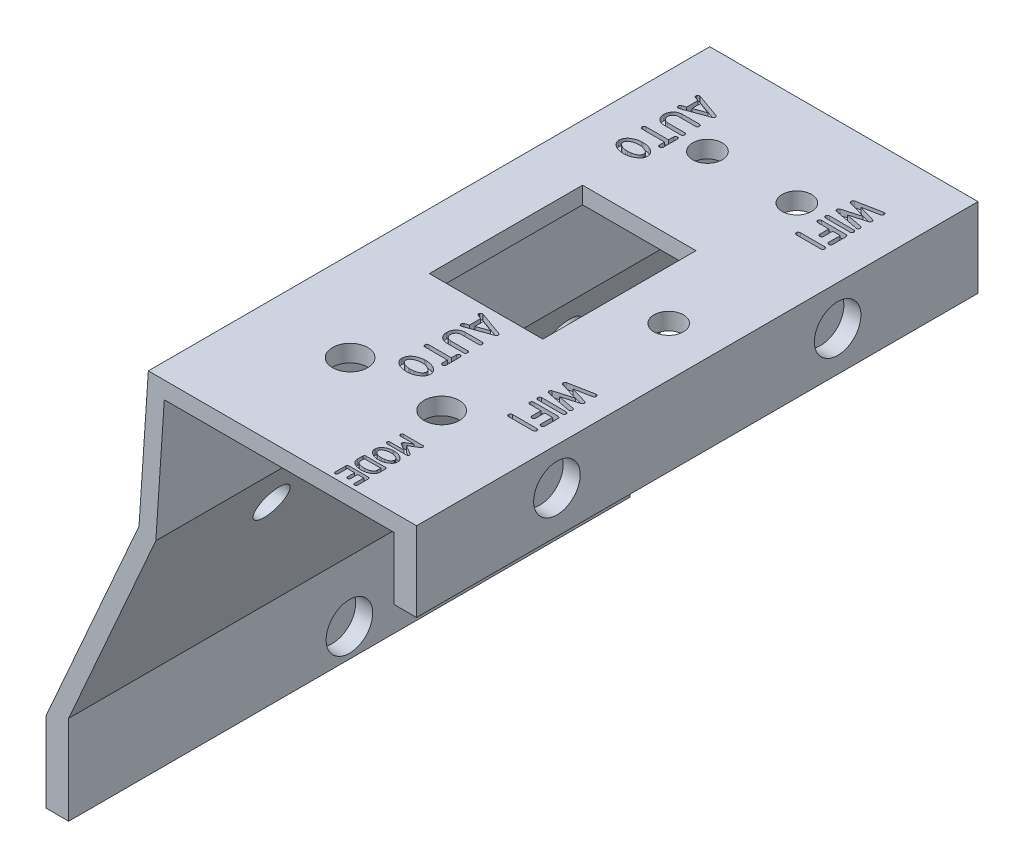
from build123d import *

# Parameters (mm, degrees)
BOSS_EXTRU_1_DEPTH      = 14.706091
BOSS_EXTRU_1_DEPTH_BACK = 84.226091
ENL_V_MAT_EXTRU_1_REACH = 125.633
ESQUISSE2_W             = 20
ESQUISSE2_H             = 27
ENL_V_MAT_EXTRU_3_REACH = 135.654
ESQUISSE4_R             = 3
ESQUISSE5_R             = 4.1
ENL_V_MAT_EXTRU_4_DEPTH = 3
ESQUISSE6_R             = 4.1
ENL_V_MAT_EXTRU_5_DEPTH = 3
ENL_V_MAT_EXTRU_6_REACH = 125.633
ESQUISSE7_R             = 3.1
ESQUISSE7_R_2           = 2.6
ENL_V_MAT_EXTRU_7_DEPTH = 1


with BuildPart() as part:
    # Esquisse1 → Boss.-Extru.1 (new, two sides: drawn at the far end of the back side and taken through both)
    with BuildSketch(Plane(origin=(0, 0, -73.054743066), x_dir=(-1, 0, 0), z_dir=(0, 0, -1)).offset(-BOSS_EXTRU_1_DEPTH_BACK)):
        Polygon((-22.356536524, 79.648115965), (-22.356536524, 93.648115965), (24.91440635, 93.648115965), (26.55625203, 69.106927027), (42.945419009, 31.995923646), (42.945419009, 17.893115965), (38.945419009, 17.893115965), (38.945419009, 33.610734644), (23.59164172, 68.377241178), (22.10168377, 90.648115965), (-18.356536524, 90.648115965), (-18.356536524, 79.648115965), align=None)
    extrude(amount=BOSS_EXTRU_1_DEPTH + BOSS_EXTRU_1_DEPTH_BACK)

    # Esquisse2 → Enlèv. mat.-Extru.1 (cut, up to next)
    with BuildSketch(Plane(origin=(0, 93.648115965, 0), x_dir=(1, 0, 0), z_dir=(0, 1, 0)), mode=Mode.PRIVATE) as enl_v_mat_extru_1_sk1:
        with Locations((-4.997419009, 41.928743066)):
            Rectangle(ESQUISSE2_W, ESQUISSE2_H)
    enl_v_mat_extru_1_tool1 = extrude(enl_v_mat_extru_1_sk1.sketch, amount=-ENL_V_MAT_EXTRU_1_REACH, mode=Mode.PRIVATE) & part.part
    add(enl_v_mat_extru_1_tool1.solids().sort_by_distance((-4.997419, 93.648116, -41.928743))[0], mode=Mode.SUBTRACT)

    # Enlèv. mat.-Extru.3: up to this plane
    enl_v_mat_extru_3_end = Plane(origin=(-26.55625203, 69.106927027, -187.776659908), z_dir=(0.9147660312656767, -0.4039840442919041, -1.783385775736144e-15))
    # Esquisse4 → Enlèv. mat.-Extru.3 (cut, up to the surface)
    with BuildSketch(Plane.ZY.offset(14.945419009), mode=Mode.PRIVATE) as enl_v_mat_extru_3_sk1:
        with Locations(Location((-63.955743066, 60.648115965, 0), (0, 0, 90))):
            Circle(ESQUISSE4_R)
    enl_v_mat_extru_3_tool1 = split(extrude(enl_v_mat_extru_3_sk1.sketch, amount=ENL_V_MAT_EXTRU_3_REACH, mode=Mode.PRIVATE), bisect_by=enl_v_mat_extru_3_end, keep=Keep.BOTH, mode=Mode.PRIVATE)
    add(enl_v_mat_extru_3_tool1.solids().sort_by_distance((-14.945419, 60.648116, -63.955743))[0], mode=Mode.SUBTRACT)
    # Esquisse4 → Enlèv. mat.-Extru.3 (cut, up to the surface)
    with BuildSketch(Plane.ZY.offset(14.945419009), mode=Mode.PRIVATE) as enl_v_mat_extru_3_sk2:
        with Locations(Location((-12.642743066, 60.648115965, 0), (0, 0, 90))):
            Circle(ESQUISSE4_R)
    enl_v_mat_extru_3_tool2 = split(extrude(enl_v_mat_extru_3_sk2.sketch, amount=ENL_V_MAT_EXTRU_3_REACH, mode=Mode.PRIVATE), bisect_by=enl_v_mat_extru_3_end, keep=Keep.BOTH, mode=Mode.PRIVATE)
    add(enl_v_mat_extru_3_tool2.solids().sort_by_distance((-14.945419, 60.648116, -12.642743))[0], mode=Mode.SUBTRACT)

    # Esquisse5 → Enlèv. mat.-Extru.4 (cut)
    with BuildSketch(Plane(origin=(22.356536524, 0, 0), x_dir=(0, 0, -1), z_dir=(1, 0, 0))):
        with Locations((13.56204842, 87.030365243)):
            Circle(ESQUISSE5_R)
        with Locations((63.027788559, 86.648115965)):
            Circle(ESQUISSE5_R)
    extrude(amount=-ENL_V_MAT_EXTRU_4_DEPTH, mode=Mode.SUBTRACT)

    # Esquisse6 → Enlèv. mat.-Extru.5 (cut)
    with BuildSketch(Plane(origin=(-38.945419009, 0, 0), x_dir=(0, 0, -1), z_dir=(1, 0, 0))):
        with Locations((38.294743066, 22.893115965)):
            Circle(ESQUISSE6_R)
    extrude(amount=-ENL_V_MAT_EXTRU_5_DEPTH, mode=Mode.SUBTRACT)

    # Esquisse7 → Enlèv. mat.-Extru.6 (cut, up to next)
    with BuildSketch(Plane(origin=(0, 93.648115965, 0), x_dir=(1, 0, 0), z_dir=(0, 1, 0)), mode=Mode.PRIVATE) as enl_v_mat_extru_6_sk1:
        with Locations(Location((-9.157425392, 8.628697572, 0), (0, 0, 270))):
            Circle(ESQUISSE7_R)
    enl_v_mat_extru_6_tool1 = extrude(enl_v_mat_extru_6_sk1.sketch, amount=-ENL_V_MAT_EXTRU_6_REACH, mode=Mode.PRIVATE) & part.part
    # Esquisse7 → Enlèv. mat.-Extru.6 (cut, up to next)
    with BuildSketch(Plane(origin=(0, 93.648115965, 0), x_dir=(1, 0, 0), z_dir=(0, 1, 0)), mode=Mode.PRIVATE) as enl_v_mat_extru_6_sk2:
        with Locations(Location((6.972869642, 8.628697572, 0), (0, 0, 270))):
            Circle(ESQUISSE7_R)
    enl_v_mat_extru_6_tool2 = extrude(enl_v_mat_extru_6_sk2.sketch, amount=-ENL_V_MAT_EXTRU_6_REACH, mode=Mode.PRIVATE) & part.part
    # Esquisse7 → Enlèv. mat.-Extru.6 (cut, up to next)
    with BuildSketch(Plane(origin=(0, 93.648115965, 0), x_dir=(1, 0, 0), z_dir=(0, 1, 0)), mode=Mode.PRIVATE) as enl_v_mat_extru_6_sk3:
        with Locations(Location((-9.157425392, 71.594788559, 0), (0, 0, 270))):
            Circle(ESQUISSE7_R_2)
    enl_v_mat_extru_6_tool3 = extrude(enl_v_mat_extru_6_sk3.sketch, amount=-ENL_V_MAT_EXTRU_6_REACH, mode=Mode.PRIVATE) & part.part
    # Esquisse7 → Enlèv. mat.-Extru.6 (cut, up to next)
    with BuildSketch(Plane(origin=(0, 93.648115965, 0), x_dir=(1, 0, 0), z_dir=(0, 1, 0)), mode=Mode.PRIVATE) as enl_v_mat_extru_6_sk4:
        with Locations(Location((6.599555566, 71.594788559, 0), (0, 0, 270))):
            Circle(ESQUISSE7_R_2)
    enl_v_mat_extru_6_tool4 = extrude(enl_v_mat_extru_6_sk4.sketch, amount=-ENL_V_MAT_EXTRU_6_REACH, mode=Mode.PRIVATE) & part.part
    # Esquisse7 → Enlèv. mat.-Extru.6 (cut, up to next)
    with BuildSketch(Plane(origin=(0, 93.648115965, 0), x_dir=(1, 0, 0), z_dir=(0, 1, 0)), mode=Mode.PRIVATE) as enl_v_mat_extru_6_sk5:
        with Locations(Location((13.679558757, 41.928743066, 0), (0, 0, 270))):
            Circle(ESQUISSE7_R_2)
    enl_v_mat_extru_6_tool5 = extrude(enl_v_mat_extru_6_sk5.sketch, amount=-ENL_V_MAT_EXTRU_6_REACH, mode=Mode.PRIVATE) & part.part
    add(enl_v_mat_extru_6_tool1.solids().sort_by_distance((-9.157425, 93.648116, -8.628698))[0], mode=Mode.SUBTRACT)
    add(enl_v_mat_extru_6_tool2.solids().sort_by_distance((6.97287, 93.648116, -8.628698))[0], mode=Mode.SUBTRACT)
    add(enl_v_mat_extru_6_tool3.solids().sort_by_distance((-9.157425, 93.648116, -71.594789))[0], mode=Mode.SUBTRACT)
    add(enl_v_mat_extru_6_tool4.solids().sort_by_distance((6.599556, 93.648116, -71.594789))[0], mode=Mode.SUBTRACT)
    add(enl_v_mat_extru_6_tool5.solids().sort_by_distance((13.679559, 93.648116, -41.928743))[0], mode=Mode.SUBTRACT)

    # Esquisse8 → Enlèv. mat.-Extru.7 (cut)
    # profile 1 of 20: a face of its own
    with BuildSketch(Plane(origin=(0, 93.648115965, 0), x_dir=(1, 0, 0), z_dir=(0, 1, 0))):
        with BuildLine():
            Line((15.816277636, 75.06165384), (12.89967119, 74.20820681))
            Line((12.89967119, 74.20820681), (15.816277636, 73.637315062))
            add(Edge.make_bspline(
                [(15.816277636, 73.637315062), (15.838129879, 73.629810084), (15.879761003, 73.615512207), (15.937077566, 73.587922124), (15.98586207, 73.555705604), (16.025729321, 73.51830784), (16.056774142, 73.476508076), (16.078886076, 73.429922907), (16.092120638, 73.378850138), (16.093694366, 73.343275657), (16.094497032, 73.325131221)],
                knots=[0, 0, 0, 0, 1.225612641, 2.334937925, 3.366850686, 4.316516048, 5.221764849, 6.113917137, 7.038020796, 8, 8, 8, 8], degree=3))
            add(Edge.make_bspline(
                [(16.094497032, 73.325131221), (16.094102257, 73.31136676), (16.09325947, 73.281981567), (16.087933707, 73.25306334), (16.085102611, 73.237690839)],
                knots=[0, 0, 0, 0, 0.936829683, 2, 2, 2, 2], degree=3))
            add(Edge.make_bspline(
                [(16.085102611, 73.237690839), (16.079662142, 73.216074213), (16.069214137, 73.174561131), (16.044734843, 73.117225916), (16.011839692, 73.068367469), (15.970637835, 73.02899521), (15.922508952, 72.997600708), (15.866517457, 72.976444221), (15.803720724, 72.962272573), (15.759273626, 72.960432378), (15.736063732, 72.959471443)],
                knots=[0, 0, 0, 0, 1.08977459, 2.092829056, 3.034500943, 3.951575601, 4.863864499, 5.827057674, 6.865308126, 8, 8, 8, 8], degree=3))
            add(Edge.make_bspline(
                [(15.736063732, 72.959471443), (15.727866694, 72.959592712), (15.711444327, 72.959835669), (15.695106612, 72.961518946), (15.686923683, 72.962362034)],
                knots=[0, 0, 0, 0, 0.998277342, 2, 2, 2, 2], degree=3))
            Line((15.686923683, 72.962362034), (11.379942905, 73.805691995))
            add(Edge.make_bspline(
                [(11.379942905, 73.805691995), (11.358480065, 73.812512909), (11.317366663, 73.825578791), (11.262101153, 73.854781324), (11.2135391, 73.886650401), (11.174195506, 73.924998763), (11.141790973, 73.967405852), (11.120047246, 74.016069453), (11.103794988, 74.068711533), (11.100995946, 74.105943058), (11.099555566, 74.125102315)],
                knots=[0, 0, 0, 0, 1.178780502, 2.258027201, 3.267263653, 4.214409182, 5.126614119, 6.047873421, 6.995440184, 8, 8, 8, 8], degree=3))
            add(Edge.make_bspline(
                [(11.099555566, 74.125102315), (11.099555566, 74.128233789), (11.099555566, 74.134014971), (11.099555566, 74.139796153), (11.099555566, 74.142445862)],
                knots=[0, 0, 0, 0, 1.083333333, 2, 2, 2, 2], degree=3))
            add(Edge.make_bspline(
                [(11.099555566, 74.142445862), (11.100144991, 74.160817554), (11.101290107, 74.196509497), (11.113255804, 74.248099362), (11.133107362, 74.295518447), (11.159941203, 74.339581054), (11.1955171, 74.379060015), (11.238668952, 74.414298048), (11.288842716, 74.446720278), (11.326438183, 74.463336799), (11.34597846, 74.47197325)],
                knots=[0, 0, 0, 0, 1.001847552, 1.946357775, 2.872181295, 3.799405386, 4.749759502, 5.75857726, 6.835018575, 8, 8, 8, 8], degree=3))
            Line((11.34597846, 74.47197325), (14.4923869, 75.393349171))
            Line((14.4923869, 75.393349171), (11.34597846, 76.308221263))
            add(Edge.make_bspline(
                [(11.34597846, 76.308221263), (11.326496203, 76.317204541), (11.289216815, 76.334394085), (11.238651115, 76.365793913), (11.195786285, 76.40038914), (11.160203305, 76.438269032), (11.133123079, 76.48025312), (11.113272155, 76.525536371), (11.101395433, 76.574514303), (11.100175509, 76.608296262), (11.099555566, 76.625463639)],
                knots=[0, 0, 0, 0, 1.201144572, 2.298395625, 3.324890908, 4.279965819, 5.19709865, 6.109752053, 7.039410425, 8, 8, 8, 8], degree=3))
            add(Edge.make_bspline(
                [(11.099555566, 76.625463639), (11.099555566, 76.630040408), (11.099555566, 76.638953064), (11.099555566, 76.64786572), (11.099555566, 76.652201607)],
                knots=[0, 0, 0, 0, 1.027027027, 2, 2, 2, 2], degree=3))
            add(Edge.make_bspline(
                [(11.099555566, 76.652201607), (11.101621646, 76.670851316), (11.105687516, 76.707552359), (11.121699573, 76.75998683), (11.14633448, 76.807641469), (11.177261132, 76.851719671), (11.217484271, 76.889987586), (11.263835143, 76.925235892), (11.319006749, 76.954750771), (11.359051545, 76.970580196), (11.379942905, 76.978838404)],
                knots=[0, 0, 0, 0, 0.981237629, 1.930992278, 2.850609895, 3.781835505, 4.736353792, 5.745575292, 6.823867188, 8, 8, 8, 8], degree=3))
            Line((11.379942905, 76.978838404), (15.686923683, 77.822891013))
            add(Edge.make_bspline(
                [(15.686923683, 77.822891013), (15.714440777, 77.822143459), (15.766924298, 77.820717647), (15.841164509, 77.80777737), (15.906545059, 77.786398146), (15.962630634, 77.75577457), (16.009681929, 77.716020418), (16.045769066, 77.666319909), (16.074297418, 77.609016674), (16.084268908, 77.566640825), (16.089438497, 77.544671617)],
                knots=[0, 0, 0, 0, 1.225468706, 2.337343979, 3.345564658, 4.277707272, 5.168442568, 6.065880062, 6.997280623, 8, 8, 8, 8], degree=3))
            add(Edge.make_bspline(
                [(16.089438497, 77.544671617), (16.090822455, 77.535293407), (16.093545788, 77.516839092), (16.09418343, 77.49819646), (16.094497032, 77.489027738)],
                knots=[0, 0, 0, 0, 1.016370451, 2, 2, 2, 2], degree=3))
            add(Edge.make_bspline(
                [(16.094497032, 77.489027738), (16.094497032, 77.485655381), (16.094497032, 77.479151551), (16.094497032, 77.472647721), (16.094497032, 77.469516248)],
                knots=[0, 0, 0, 0, 1.037037037, 2, 2, 2, 2], degree=3))
            add(Edge.make_bspline(
                [(16.094497032, 77.469516248), (16.093679405, 77.451614951), (16.092065798, 77.416286299), (16.0788019, 77.365230978), (16.056422682, 77.317954768), (16.025920482, 77.274173089), (15.985624177, 77.23466555), (15.937210869, 77.198778513), (15.879904438, 77.166819632), (15.838147869, 77.149211314), (15.816277636, 77.139988859)],
                knots=[0, 0, 0, 0, 0.930284795, 1.835940031, 2.721611252, 3.639321757, 4.596229516, 5.64376523, 6.765908999, 8, 8, 8, 8], degree=3))
            Line((15.816277636, 77.139988859), (12.894612655, 76.57632359))
            Line((12.894612655, 76.57632359), (15.816277636, 75.72287656))
            add(Edge.make_bspline(
                [(15.816277636, 75.72287656), (15.835259492, 75.713857632), (15.872054028, 75.696375294), (15.922355351, 75.6648233), (15.964681773, 75.62824843), (15.999878512, 75.58821319), (16.027960701, 75.544194563), (16.048100912, 75.496020017), (16.061602584, 75.443904087), (16.06423731, 75.407644614), (16.06559112, 75.389013285)],
                knots=[0, 0, 0, 0, 1.139967109, 2.209718503, 3.210731445, 4.164988922, 5.093378488, 6.030561205, 6.988036495, 8, 8, 8, 8], degree=3))
            add(Edge.make_bspline(
                [(16.06559112, 75.389013285), (16.06559112, 75.386604459), (16.06559112, 75.381545924), (16.06559112, 75.37648739), (16.06559112, 75.373837681)],
                knots=[0, 0, 0, 0, 0.952380952, 2, 2, 2, 2], degree=3))
            add(Edge.make_bspline(
                [(16.06559112, 75.373837681), (16.065064187, 75.356169126), (16.064032489, 75.321575316), (16.051044759, 75.27207656), (16.031540493, 75.226566307), (16.003941777, 75.184922435), (15.968305935, 75.147569298), (15.924993351, 75.113937274), (15.873705332, 75.084949026), (15.835987238, 75.069648917), (15.816277636, 75.06165384)],
                knots=[0, 0, 0, 0, 0.986913333, 1.932308146, 2.844403899, 3.749692872, 4.713383657, 5.722444809, 6.809862793, 8, 8, 8, 8], degree=3))
        make_face()
    # profile 2 of 20: a face of its own
    with BuildSketch(Plane(origin=(0, 93.648115965, 0), x_dir=(1, 0, 0), z_dir=(0, 1, 0))):
        with BuildLine():
            add(Edge.make_bspline(
                [(11.436309432, 71.811184119), (11.409396355, 71.816256138), (11.358348114, 71.825876654), (11.288153689, 71.850543762), (11.228153116, 71.882396204), (11.179061021, 71.922264241), (11.140747843, 71.970066092), (11.114088831, 72.025416125), (11.096648166, 72.08787853), (11.095232611, 72.132156065), (11.094497032, 72.155164463)],
                knots=[0, 0, 0, 0, 1.222689555, 2.319175593, 3.31161651, 4.244886815, 5.125960036, 6.026358336, 6.974415993, 8, 8, 8, 8], degree=3))
            add(Edge.make_bspline(
                [(11.094497032, 72.155164463), (11.094497032, 72.155405345), (11.094497032, 72.156368876), (11.094497032, 72.157332406), (11.094497032, 72.158055054)],
                knots=[0, 0, 0, 0, 0.5, 2, 2, 2, 2], degree=3))
            add(Edge.make_bspline(
                [(11.094497032, 72.158055054), (11.095246048, 72.181296311), (11.096687802, 72.226032524), (11.113899068, 72.289081791), (11.140983546, 72.344656579), (11.1787843, 72.393102297), (11.228190733, 72.432962378), (11.288142229, 72.464852495), (11.358351499, 72.489508207), (11.409397524, 72.499130424), (11.436309432, 72.504203341)],
                knots=[0, 0, 0, 0, 1.032503983, 1.987427655, 2.884509026, 3.770750695, 4.700582976, 5.689367893, 6.781814646, 8, 8, 8, 8], degree=3))
            Line((11.436309432, 72.504203341), (15.748348744, 72.504203341))
            add(Edge.make_bspline(
                [(15.748348744, 72.504203341), (15.775448204, 72.498989133), (15.827012566, 72.489067631), (15.898834257, 72.466086929), (15.958845951, 72.432979012), (16.008922245, 72.393448983), (16.047913014, 72.34596718), (16.075201737, 72.290323782), (16.092229877, 72.227710567), (16.093724457, 72.183220623), (16.094497032, 72.160222997)],
                knots=[0, 0, 0, 0, 1.22436443, 2.329698535, 3.329521239, 4.249348588, 5.145837596, 6.030200491, 6.981776364, 8, 8, 8, 8], degree=3))
            add(Edge.make_bspline(
                [(16.094497032, 72.160222997), (16.094497032, 72.159982114), (16.094497032, 72.159259467), (16.094497032, 72.158536819), (16.094497032, 72.158055054)],
                knots=[0, 0, 0, 0, 0.666666667, 2, 2, 2, 2], degree=3))
            add(Edge.make_bspline(
                [(16.094497032, 72.158055054), (16.093756228, 72.134807307), (16.092330283, 72.090058605), (16.075009468, 72.027095889), (16.048178182, 71.970944343), (16.00866477, 71.923449512), (15.959140018, 71.882985614), (15.898649641, 71.85024738), (15.82718647, 71.826072735), (15.775481717, 71.816308219), (15.748348744, 71.811184119)],
                knots=[0, 0, 0, 0, 1.024984569, 1.972953821, 2.86350202, 3.756593194, 4.679653787, 5.675687008, 6.780276102, 8, 8, 8, 8], degree=3))
            Line((15.748348744, 71.811184119), (11.436309432, 71.811184119))
        make_face()
    # profile 3 of 20: a face of its own
    with BuildSketch(Plane(origin=(0, 93.648115965, 0), x_dir=(1, 0, 0), z_dir=(0, 1, 0))):
        with BuildLine():
            Line((11.445703853, 71.116719601), (15.748348744, 71.116719601))
            add(Edge.make_bspline(
                [(15.748348744, 71.116719601), (15.773811375, 71.11238639), (15.822436463, 71.104111409), (15.889772321, 71.080770828), (15.947984693, 71.049683927), (15.996938153, 71.009789585), (16.036444714, 70.961693323), (16.065666992, 70.904954771), (16.086265456, 70.840712721), (16.091680192, 70.794573655), (16.094497032, 70.770571313)],
                knots=[0, 0, 0, 0, 1.152409192, 2.200715219, 3.168714436, 4.086471381, 5.004228327, 5.928524594, 6.9223826, 8, 8, 8, 8], degree=3))
            Line((16.094497032, 70.770571313), (16.094497032, 68.409681011))
            add(Edge.make_bspline(
                [(16.094497032, 68.409681011), (16.091417298, 68.38305004), (16.085593548, 68.332691109), (16.065359266, 68.262638513), (16.035732728, 68.203117168), (15.996785071, 68.153695615), (15.947430656, 68.116027563), (15.889252551, 68.089103188), (15.821944645, 68.073351238), (15.749097721, 68.069480712), (15.676274385, 68.073012215), (15.609745347, 68.090078799), (15.551809484, 68.116591947), (15.503549878, 68.155535646), (15.464529285, 68.204797766), (15.43636771, 68.265512515), (15.416827872, 68.336087006), (15.411979012, 68.387144205), (15.409426935, 68.414016898)],
                knots=[0, 0, 0, 0, 1.178823688, 2.229145227, 3.191923342, 4.089596009, 4.974142994, 5.899271861, 6.892126947, 7.997540461, 9.102953976, 10.08807625, 11.003612333, 11.886377494, 12.792343357, 13.745730581, 14.813521069, 16, 16, 16, 16], degree=3))
            Line((15.409426935, 68.414016898), (15.409426935, 70.431649504))
            Line((15.409426935, 70.431649504), (14.07541913, 70.431649504))
            Line((14.07541913, 70.431649504), (14.07541913, 68.858445284))
            add(Edge.make_bspline(
                [(14.07541913, 68.858445284), (14.072583553, 68.831578965), (14.067223383, 68.780792826), (14.047711186, 68.710403526), (14.019452423, 68.650266525), (13.981585621, 68.600392979), (13.932863634, 68.562787846), (13.87592326, 68.535931583), (13.810235428, 68.518665111), (13.763352295, 68.517333869), (13.738665264, 68.516632883)],
                knots=[0, 0, 0, 0, 1.196905499, 2.262543292, 3.223196514, 4.129476211, 5.012333206, 5.925203658, 6.907484277, 8, 8, 8, 8], degree=3))
            add(Edge.make_bspline(
                [(13.738665264, 68.516632883), (13.714942348, 68.517364777), (13.669491129, 68.518767029), (13.60548792, 68.536026729), (13.549240693, 68.563131019), (13.500043824, 68.60066997), (13.460159789, 68.650354144), (13.428285437, 68.710277202), (13.403450851, 68.780407347), (13.39439604, 68.831520987), (13.389626386, 68.858445284)],
                knots=[0, 0, 0, 0, 1.047663218, 2.007239333, 2.908585591, 3.797994643, 4.722322707, 5.705254432, 6.791234358, 8, 8, 8, 8], degree=3))
            Line((13.389626386, 68.858445284), (13.389626386, 70.431649504))
            Line((13.389626386, 70.431649504), (11.445703853, 70.431649504))
            add(Edge.make_bspline(
                [(11.445703853, 70.431649504), (11.419325671, 70.434263136), (11.369306068, 70.439219235), (11.299902951, 70.457944746), (11.240345727, 70.485350747), (11.191506906, 70.522970155), (11.153001857, 70.569655723), (11.124990931, 70.625342728), (11.10856001, 70.690176049), (11.105971997, 70.736269578), (11.104614101, 70.760454244)],
                knots=[0, 0, 0, 0, 1.192101837, 2.260522003, 3.2212548, 4.126038621, 5.012162391, 5.924200142, 6.910855177, 8, 8, 8, 8], degree=3))
            add(Edge.make_bspline(
                [(11.104614101, 70.760454244), (11.104614101, 70.762140422), (11.104614101, 70.765512779), (11.104614101, 70.768885135), (11.104614101, 70.770571313)],
                knots=[0, 0, 0, 0, 1, 2, 2, 2, 2], degree=3))
            add(Edge.make_bspline(
                [(11.104614101, 70.770571313), (11.105334319, 70.794069007), (11.106720966, 70.83930945), (11.124296863, 70.902740126), (11.149898403, 70.959690184), (11.189029071, 71.007231595), (11.237676616, 71.048146185), (11.297879658, 71.079200317), (11.367901497, 71.10373202), (11.418770822, 71.112223658), (11.445703853, 71.116719601)],
                knots=[0, 0, 0, 0, 1.041138228, 2.004518225, 2.904802914, 3.795938976, 4.715681658, 5.711930166, 6.788569427, 8, 8, 8, 8], degree=3))
        make_face()
    # profile 4 of 20: a face of its own
    with BuildSketch(Plane(origin=(0, 93.648115965, 0), x_dir=(1, 0, 0), z_dir=(0, 1, 0))):
        with BuildLine():
            add(Edge.make_bspline(
                [(11.436309432, 66.677494279), (11.409396355, 66.682566299), (11.358348114, 66.692186815), (11.288153689, 66.716853923), (11.228153116, 66.748706364), (11.179061021, 66.788574402), (11.140747843, 66.836376253), (11.114088831, 66.891726286), (11.096648166, 66.95418869), (11.095232611, 66.998466225), (11.094497032, 67.021474623)],
                knots=[0, 0, 0, 0, 1.222689555, 2.319175593, 3.31161651, 4.244886815, 5.125960036, 6.026358336, 6.974415993, 8, 8, 8, 8], degree=3))
            add(Edge.make_bspline(
                [(11.094497032, 67.021474623), (11.094497032, 67.021715506), (11.094497032, 67.022679036), (11.094497032, 67.023642566), (11.094497032, 67.024365214)],
                knots=[0, 0, 0, 0, 0.5, 2, 2, 2, 2], degree=3))
            add(Edge.make_bspline(
                [(11.094497032, 67.024365214), (11.095246048, 67.047606472), (11.096687802, 67.092342684), (11.113899068, 67.155391952), (11.140983546, 67.210966739), (11.1787843, 67.259412458), (11.228190733, 67.299272539), (11.288142229, 67.331162655), (11.358351499, 67.355818367), (11.409397524, 67.365440585), (11.436309432, 67.370513501)],
                knots=[0, 0, 0, 0, 1.032503983, 1.987427655, 2.884509026, 3.770750695, 4.700582976, 5.689367893, 6.781814646, 8, 8, 8, 8], degree=3))
            Line((11.436309432, 67.370513501), (15.748348744, 67.370513501))
            add(Edge.make_bspline(
                [(15.748348744, 67.370513501), (15.775448204, 67.365299293), (15.827012566, 67.355377791), (15.898834257, 67.332397089), (15.958845951, 67.299289173), (16.008922245, 67.259759144), (16.047913014, 67.21227734), (16.075201737, 67.156633942), (16.092229877, 67.094020727), (16.093724457, 67.049530783), (16.094497032, 67.026533157)],
                knots=[0, 0, 0, 0, 1.22436443, 2.329698535, 3.329521239, 4.249348588, 5.145837596, 6.030200491, 6.981776364, 8, 8, 8, 8], degree=3))
            add(Edge.make_bspline(
                [(16.094497032, 67.026533157), (16.094497032, 67.026292275), (16.094497032, 67.025569627), (16.094497032, 67.024846979), (16.094497032, 67.024365214)],
                knots=[0, 0, 0, 0, 0.666666667, 2, 2, 2, 2], degree=3))
            add(Edge.make_bspline(
                [(16.094497032, 67.024365214), (16.093756228, 67.001117468), (16.092330283, 66.956368765), (16.075009468, 66.893406049), (16.048178182, 66.837254504), (16.00866477, 66.789759672), (15.959140018, 66.749295774), (15.898649641, 66.71655754), (15.82718647, 66.692382895), (15.775481717, 66.682618379), (15.748348744, 66.677494279)],
                knots=[0, 0, 0, 0, 1.024984569, 1.972953821, 2.86350202, 3.756593194, 4.679653787, 5.675687008, 6.780276102, 8, 8, 8, 8], degree=3))
            Line((15.748348744, 66.677494279), (11.436309432, 66.677494279))
        make_face()
    # profile 5 of 20: a face of its own
    with BuildSketch(Plane(origin=(0, 93.648115965, 0), x_dir=(1, 0, 0), z_dir=(0, 1, 0))):
        with BuildLine():
            add(Edge.make_bspline(
                [(-15.099107716, 64.026759235), (-15.144496842, 64.012077727), (-15.234925241, 63.982827874), (-15.372688325, 63.947424975), (-15.510870805, 63.915761886), (-15.650577701, 63.890905712), (-15.790995148, 63.87015132), (-15.932614302, 63.856983345), (-16.075039653, 63.84767905), (-16.170538124, 63.846626026), (-16.218489129, 63.84609729)],
                knots=[0, 0, 0, 0, 1.005228483, 2.002708781, 2.99669436, 3.992545315, 4.992722399, 5.987433817, 6.989464752, 8, 8, 8, 8], degree=3))
            add(Edge.make_bspline(
                [(-16.218489129, 63.84609729), (-16.265715179, 63.846696347), (-16.359978277, 63.847892064), (-16.454085263, 63.853443971), (-16.501044412, 63.856214358)],
                knots=[0, 0, 0, 0, 1.00200505, 2, 2, 2, 2], degree=3))
            add(Edge.make_bspline(
                [(-16.501044412, 63.856214358), (-16.561096557, 63.861600502), (-16.680132723, 63.872276987), (-16.856256256, 63.899358635), (-17.028321926, 63.935314987), (-17.196487793, 63.980994066), (-17.360480332, 64.03598522), (-17.520733271, 64.099756553), (-17.67700547, 64.172389601), (-17.777550548, 64.228021277), (-17.827825739, 64.255838582)],
                knots=[0, 0, 0, 0, 1.035259213, 2.052104639, 3.058172126, 4.052682658, 5.0429855, 6.027047422, 7.013471666, 8, 8, 8, 8], degree=3))
            add(Edge.make_bspline(
                [(-17.827825739, 64.255838582), (-17.858614933, 64.274557118), (-17.920013178, 64.311884673), (-18.008648828, 64.373490147), (-18.092850788, 64.440929629), (-18.174216762, 64.512467099), (-18.251579576, 64.589506467), (-18.325872421, 64.670802644), (-18.396630074, 64.757380012), (-18.440235406, 64.818294574), (-18.462310491, 64.84913241)],
                knots=[0, 0, 0, 0, 0.987521339, 1.969264867, 2.956079636, 3.94304901, 4.937498865, 5.947024088, 6.960686373, 8, 8, 8, 8], degree=3))
            add(Edge.make_bspline(
                [(-18.462310491, 64.84913241), (-18.478369612, 64.873217073), (-18.510104225, 64.92081105), (-18.550279369, 64.995813096), (-18.58554605, 65.071806523), (-18.613360593, 65.149556157), (-18.635360371, 65.228534563), (-18.65127051, 65.308698799), (-18.660993595, 65.390635607), (-18.661985236, 65.445772234), (-18.662483926, 65.473500093)],
                knots=[0, 0, 0, 0, 1.0425072, 2.060110416, 3.062196159, 4.058854179, 5.031758345, 6.01394921, 7.001227694, 8, 8, 8, 8], degree=3))
            add(Edge.make_bspline(
                [(-18.662483926, 65.473500093), (-18.66172145, 65.507281165), (-18.660174734, 65.575807572), (-18.650198624, 65.643624043), (-18.645140379, 65.678009416)],
                knots=[0, 0, 0, 0, 0.985928566, 2, 2, 2, 2], degree=3))
            add(Edge.make_bspline(
                [(-18.645140379, 65.678009416), (-18.632889161, 65.738061603), (-18.608752286, 65.856374097), (-18.551735929, 66.025941765), (-18.479252343, 66.184720801), (-18.390545784, 66.332370017), (-18.285589947, 66.469337598), (-18.164464221, 66.595129204), (-18.0274837, 66.710379252), (-17.874989897, 66.812095557), (-17.713435792, 66.904289848), (-17.546125406, 66.987286761), (-17.373592626, 67.058255513), (-17.197458277, 67.12127905), (-17.016017037, 67.171147502), (-16.830951717, 67.212762483), (-16.641033969, 67.243593967), (-16.512457527, 67.254901467), (-16.447568476, 67.260608057)],
                knots=[0, 0, 0, 0, 1.005151345, 1.98031024, 2.928521969, 3.864865293, 4.801100107, 5.754580245, 6.725466264, 7.733180091, 8.758545319, 9.776958838, 10.796047423, 11.818863829, 12.845249859, 13.882127847, 14.931167219, 16, 16, 16, 16], degree=3))
            add(Edge.make_bspline(
                [(-16.447568476, 67.260608057), (-16.401577584, 67.263739931), (-16.30990658, 67.269982515), (-16.218024809, 67.270478149), (-16.172239671, 67.270725126)],
                knots=[0, 0, 0, 0, 1.003390173, 2, 2, 2, 2], degree=3))
            add(Edge.make_bspline(
                [(-16.172239671, 67.270725126), (-16.118751149, 67.269948165), (-16.011921836, 67.268396388), (-15.851984077, 67.258400845), (-15.693161937, 67.240004053), (-15.535284884, 67.215311149), (-15.378098403, 67.184695965), (-15.222142786, 67.144976214), (-15.066553357, 67.100195412), (-14.964527554, 67.064082981), (-14.913387236, 67.045981666)],
                knots=[0, 0, 0, 0, 0.998780158, 1.994801754, 2.990701472, 3.983090818, 4.97810648, 5.979546698, 6.98725007, 8, 8, 8, 8], degree=3))
            add(Edge.make_bspline(
                [(-14.913387236, 67.045981666), (-14.853051602, 67.022749012), (-14.734690465, 66.977173237), (-14.566314148, 66.895450076), (-14.411406131, 66.80232875), (-14.267868767, 66.700989407), (-14.139064937, 66.586944411), (-14.021024403, 66.464808864), (-13.91625626, 66.331638121), (-13.857407279, 66.235543738), (-13.827970268, 66.187476101)],
                knots=[0, 0, 0, 0, 1.097299781, 2.152586126, 3.172307183, 4.162997876, 5.130891392, 6.088231204, 7.04370885, 8, 8, 8, 8], degree=3))
            add(Edge.make_bspline(
                [(-13.827970268, 66.187476101), (-13.802566867, 66.139649993), (-13.752470855, 66.04533596), (-13.700814536, 65.894894505), (-13.668107079, 65.741339456), (-13.664358654, 65.637463001), (-13.662483926, 65.5855105)],
                knots=[0, 0, 0, 0, 1.028039231, 2.027313736, 3.01338581, 4, 4, 4, 4], degree=3))
            add(Edge.make_bspline(
                [(-13.662483926, 65.5855105), (-13.663877204, 65.536537246), (-13.666608373, 65.440537553), (-13.687946871, 65.299919119), (-13.723453967, 65.166458564), (-13.772583437, 65.039227639), (-13.837864358, 64.919880898), (-13.915314708, 64.806185662), (-14.007783588, 64.699997898), (-14.114557787, 64.603341809), (-14.22787214, 64.511781753), (-14.345342549, 64.425957978), (-14.464402359, 64.344812182), (-14.586084673, 64.269454734), (-14.71045877, 64.199895475), (-14.837859626, 64.136730878), (-14.966829258, 64.077442401), (-15.055071116, 64.043632083), (-15.099107716, 64.026759235)],
                knots=[0, 0, 0, 0, 1.037843655, 2.034430339, 3.006742073, 3.960684813, 4.917983682, 5.883945821, 6.872058589, 7.894665807, 8.932999262, 9.959424092, 10.977738595, 11.986676638, 12.992508657, 13.9973032, 15.000565509, 16, 16, 16, 16], degree=3))
        make_face()
        with BuildLine():
            add(Edge.make_bspline(
                [(-14.354780501, 65.565999009), (-14.355958499, 65.602510042), (-14.35826199, 65.673904731), (-14.382506326, 65.776971345), (-14.4204744, 65.873288817), (-14.473469481, 65.962959776), (-14.543190291, 66.044699767), (-14.626845672, 66.120195059), (-14.726120585, 66.188378752), (-14.838364405, 66.246571772), (-14.954798467, 66.29963189), (-15.068562127, 66.349744328), (-15.178212887, 66.39409666), (-15.283388867, 66.432816753), (-15.38408204, 66.467480038), (-15.480718837, 66.495203411), (-15.572674069, 66.518923129), (-15.632842443, 66.530766016), (-15.662050338, 66.53651498)],
                knots=[0, 0, 0, 0, 0.993535604, 1.942787115, 2.868125326, 3.807173339, 4.767148646, 5.785112777, 6.870518026, 8.039533043, 9.226241594, 10.358165267, 11.427366244, 12.449366116, 13.412703084, 14.328959953, 15.188817, 16, 16, 16, 16], degree=3))
            add(Edge.make_bspline(
                [(-15.662050338, 66.53651498), (-15.696205327, 66.542185091), (-15.767161966, 66.553964687), (-15.878183071, 66.56478626), (-15.997009257, 66.572464878), (-16.078763202, 66.573062015), (-16.120931679, 66.573370017)],
                knots=[0, 0, 0, 0, 0.901110678, 1.872048178, 2.902407845, 4, 4, 4, 4], degree=3))
            add(Edge.make_bspline(
                [(-16.120931679, 66.573370017), (-16.144299449, 66.573237831), (-16.192248833, 66.572966594), (-16.240170951, 66.571322356), (-16.264738587, 66.570479426)],
                knots=[0, 0, 0, 0, 0.974684892, 2, 2, 2, 2], degree=3))
            add(Edge.make_bspline(
                [(-16.264738587, 66.570479426), (-16.32357297, 66.567602641), (-16.441066233, 66.561857652), (-16.616375073, 66.540007519), (-16.790865513, 66.509934247), (-16.963255138, 66.469774633), (-17.131120937, 66.419860207), (-17.291888313, 66.358481035), (-17.443506895, 66.284580924), (-17.562989971, 66.214132753), (-17.652295177, 66.152310655), (-17.712180201, 66.100925991), (-17.768015966, 66.047953906), (-17.815908368, 65.989372865), (-17.860079508, 65.928990028), (-17.896561048, 65.863827218), (-17.929199093, 65.796138947), (-17.944931679, 65.748311785), (-17.952843805, 65.724258874)],
                knots=[0, 0, 0, 0, 1.412978842, 2.821742795, 4.235714329, 5.660172904, 7.066373352, 8.434973293, 9.784373954, 11.108709726, 11.759798832, 12.387373225, 13.000487732, 13.60363134, 14.200287099, 14.793179493, 15.393074025, 16, 16, 16, 16], degree=3))
            add(Edge.make_bspline(
                [(-17.952843805, 65.724258874), (-17.961810954, 65.690245711), (-17.979122214, 65.62458262), (-17.982357997, 65.556770978), (-17.983917659, 65.524085438)],
                knots=[0, 0, 0, 0, 1.035990303, 2, 2, 2, 2], degree=3))
            add(Edge.make_bspline(
                [(-17.983917659, 65.524085438), (-17.983256062, 65.505998575), (-17.981954145, 65.470406531), (-17.974761091, 65.417534748), (-17.961752214, 65.366436604), (-17.943203965, 65.316753216), (-17.920562448, 65.268109741), (-17.890644359, 65.22204347), (-17.85810118, 65.175836267), (-17.831804556, 65.148007865), (-17.818431317, 65.133855636)],
                knots=[0, 0, 0, 0, 0.998188008, 1.964273818, 2.937736173, 3.900617101, 4.887415178, 5.890457572, 6.927185002, 8, 8, 8, 8], degree=3))
            add(Edge.make_bspline(
                [(-17.818431317, 65.133855636), (-17.777629028, 65.094371196), (-17.697878241, 65.017196231), (-17.569948606, 64.915510253), (-17.438411548, 64.829238255), (-17.346300986, 64.783470675), (-17.301015506, 64.760969381)],
                knots=[0, 0, 0, 0, 1.062237211, 2.076213261, 3.054184405, 4, 4, 4, 4], degree=3))
            add(Edge.make_bspline(
                [(-17.301015506, 64.760969381), (-17.276806206, 64.750314439), (-17.227273111, 64.728514047), (-17.148634652, 64.700671341), (-17.064739733, 64.674651577), (-16.975334791, 64.650865175), (-16.880349643, 64.629854687), (-16.779970772, 64.612179105), (-16.674212438, 64.596065808), (-16.601762111, 64.587557711), (-16.564637417, 64.583198027)],
                knots=[0, 0, 0, 0, 0.834303896, 1.707015631, 2.630131464, 3.605371712, 4.625115637, 5.698508383, 6.820679264, 8, 8, 8, 8], degree=3))
            add(Edge.make_bspline(
                [(-16.564637417, 64.583198027), (-16.509754234, 64.578139511), (-16.400379052, 64.568058534), (-16.290550533, 64.566587411), (-16.235832676, 64.56585448)],
                knots=[0, 0, 0, 0, 1.003576529, 2, 2, 2, 2], degree=3))
            add(Edge.make_bspline(
                [(-16.235832676, 64.56585448), (-16.229087963, 64.56585448), (-16.215116773, 64.56585448), (-16.201145583, 64.56585448), (-16.193919105, 64.56585448)],
                knots=[0, 0, 0, 0, 0.965517241, 2, 2, 2, 2], degree=3))
            add(Edge.make_bspline(
                [(-16.193919105, 64.56585448), (-16.103231888, 64.568193688), (-15.922121002, 64.572865305), (-15.742390432, 64.595663096), (-15.652655916, 64.607045403)],
                knots=[0, 0, 0, 0, 1.001455169, 2, 2, 2, 2], degree=3))
            add(Edge.make_bspline(
                [(-15.652655916, 64.607045403), (-15.57867621, 64.619984721), (-15.432925345, 64.645477074), (-15.221856912, 64.705141225), (-15.022499599, 64.782475478), (-14.864665433, 64.858692576), (-14.747504314, 64.92937326), (-14.668323527, 64.98810545), (-14.597503436, 65.052123741), (-14.534989164, 65.121859826), (-14.480775552, 65.19699882), (-14.434871615, 65.277431049), (-14.396558851, 65.362951899), (-14.378896892, 65.423392519), (-14.369956104, 65.453988603)],
                knots=[0, 0, 0, 0, 1.660497363, 3.271423165, 4.841796721, 6.385944421, 7.141684003, 7.865277358, 8.563124983, 9.249879497, 9.933090222, 10.608527439, 11.295612599, 12, 12, 12, 12], degree=3))
            add(Edge.make_bspline(
                [(-14.369956104, 65.453988603), (-14.365447234, 65.47124027), (-14.355855214, 65.507940892), (-14.355152758, 65.545888978), (-14.354780501, 65.565999009)],
                knots=[0, 0, 0, 0, 0.940129369, 2, 2, 2, 2], degree=3))
        make_face(mode=Mode.SUBTRACT)
    # profile 6 of 20: a face of its own
    with BuildSketch(Plane(origin=(0, 93.648115965, 0), x_dir=(1, 0, 0), z_dir=(0, 1, 0))):
        with BuildLine():
            Line((-18.315612991, 69.919229245), (-14.350444614, 69.919229245))
            Line((-14.350444614, 69.919229245), (-14.350444614, 70.813867198))
            add(Edge.make_bspline(
                [(-14.350444614, 70.813867198), (-14.347656167, 70.840739959), (-14.342378232, 70.891604343), (-14.32217938, 70.962180523), (-14.292192163, 71.021960805), (-14.2537526, 71.071723605), (-14.204882867, 71.109755889), (-14.147281274, 71.136338783), (-14.08092253, 71.153654878), (-14.033561692, 71.154981369), (-14.008632214, 71.155679599)],
                knots=[0, 0, 0, 0, 1.189523094, 2.251512628, 3.215644726, 4.122884676, 5.00029629, 5.917119918, 6.903627599, 8, 8, 8, 8], degree=3))
            add(Edge.make_bspline(
                [(-14.008632214, 71.155679599), (-13.983468556, 71.154967905), (-13.935645578, 71.153615346), (-13.868721712, 71.136512762), (-13.810828838, 71.109557295), (-13.761422105, 71.071770909), (-13.722070216, 71.022205775), (-13.692381332, 70.962031232), (-13.671172408, 70.891701552), (-13.665485935, 70.840760206), (-13.662483926, 70.813867198)],
                knots=[0, 0, 0, 0, 1.101407997, 2.093201626, 3.005420221, 3.886762008, 4.796038349, 5.755327793, 6.81499034, 8, 8, 8, 8], degree=3))
            Line((-13.662483926, 70.813867198), (-13.662483926, 68.338798547))
            add(Edge.make_bspline(
                [(-13.662483926, 68.338798547), (-13.665563664, 68.312167557), (-13.671387422, 68.261808589), (-13.69162165, 68.191756236), (-13.72124837, 68.132234085), (-13.760195406, 68.082815281), (-13.809552107, 68.045137108), (-13.867935118, 68.018154158), (-13.935535653, 68.002249438), (-13.983491549, 68.000692799), (-14.008632214, 67.999876737)],
                knots=[0, 0, 0, 0, 1.177667869, 2.226959584, 3.188793709, 4.085586222, 4.969265921, 5.893487713, 6.895670327, 8, 8, 8, 8], degree=3))
            add(Edge.make_bspline(
                [(-14.008632214, 67.999876737), (-14.03353102, 68.000694943), (-14.081009447, 68.002255143), (-14.147929777, 68.018119799), (-14.20569394, 68.045338295), (-14.254870666, 68.08281764), (-14.293934908, 68.132067995), (-14.322705521, 68.191854096), (-14.342239762, 68.26186061), (-14.347605178, 68.312172797), (-14.350444614, 68.338798547)],
                knots=[0, 0, 0, 0, 1.099202618, 2.096020583, 3.015210934, 3.903288498, 4.804544134, 5.766403515, 6.817956769, 8, 8, 8, 8], degree=3))
            Line((-14.350444614, 68.338798547), (-14.350444614, 69.231268557))
            Line((-14.350444614, 69.231268557), (-18.315612991, 69.231268557))
            add(Edge.make_bspline(
                [(-18.315612991, 69.231268557), (-18.342533789, 69.2365779), (-18.393630962, 69.246655329), (-18.463828097, 69.272064621), (-18.523834118, 69.304662643), (-18.572886871, 69.345278444), (-18.611413046, 69.393934495), (-18.637656571, 69.450430804), (-18.655367933, 69.513974277), (-18.656719665, 69.558978897), (-18.657425392, 69.582475379)],
                knots=[0, 0, 0, 0, 1.213227819, 2.30277391, 3.290803613, 4.22189966, 5.102862725, 6.013774861, 6.963010847, 8, 8, 8, 8], degree=3))
            add(Edge.make_bspline(
                [(-18.657425392, 69.582475379), (-18.657425392, 69.583438909), (-18.657425392, 69.585847735), (-18.657425392, 69.588256561), (-18.657425392, 69.589701857)],
                knots=[0, 0, 0, 0, 0.8, 2, 2, 2, 2], degree=3))
            add(Edge.make_bspline(
                [(-18.657425392, 69.589701857), (-18.656078054, 69.613650569), (-18.653511045, 69.659278751), (-18.636901177, 69.723568815), (-18.609045217, 69.779052298), (-18.570541339, 69.825759899), (-18.52139179, 69.863479153), (-18.461662936, 69.891360295), (-18.392078453, 69.910994165), (-18.342002077, 69.916387227), (-18.315612991, 69.919229245)],
                knots=[0, 0, 0, 0, 1.078676185, 2.055143142, 2.96746411, 3.85386305, 4.758927835, 5.734429665, 6.806097118, 8, 8, 8, 8], degree=3))
        make_face()
    # profile 7 of 20: a face of its own
    with BuildSketch(Plane(origin=(0, 93.648115965, 0), x_dir=(1, 0, 0), z_dir=(0, 1, 0))):
        with BuildLine():
            Line((-17.011233746, 71.752586667), (-17.059651147, 71.752586667))
            add(Edge.make_bspline(
                [(-17.059651147, 71.752586667), (-17.077959143, 71.75377789), (-17.110481822, 71.755894003), (-17.153354284, 71.758848923), (-17.183957729, 71.760868588), (-17.200327462, 71.762210243), (-17.206348647, 71.762703736)],
                knots=[0, 0, 0, 0, 1.497203658, 2.659661638, 3.506991089, 4, 4, 4, 4], degree=3))
            add(Edge.make_bspline(
                [(-17.206348647, 71.762703736), (-17.266543488, 71.772221508), (-17.383906013, 71.790778412), (-17.552285365, 71.836035415), (-17.708566171, 71.893925412), (-17.853012982, 71.964048601), (-17.985981638, 72.046554227), (-18.105433485, 72.14351187), (-18.213872044, 72.25221287), (-18.275332607, 72.333790801), (-18.30621857, 72.374786406)],
                knots=[0, 0, 0, 0, 1.127533537, 2.198364169, 3.221302365, 4.208480874, 5.16611142, 6.111138401, 7.050784658, 8, 8, 8, 8], degree=3))
            add(Edge.make_bspline(
                [(-18.30621857, 72.374786406), (-18.332810481, 72.414657707), (-18.385259398, 72.493298408), (-18.453088754, 72.616134578), (-18.511726191, 72.740306476), (-18.55731808, 72.867467227), (-18.595095786, 72.995620125), (-18.620545954, 73.126040683), (-18.637432218, 73.258140141), (-18.639195752, 73.346936068), (-18.640081845, 73.391551835)],
                knots=[0, 0, 0, 0, 1.057506459, 2.085787187, 3.094454699, 4.085262521, 5.064719227, 6.040792652, 7.015590695, 8, 8, 8, 8], degree=3))
            add(Edge.make_bspline(
                [(-18.640081845, 73.391551835), (-18.639539878, 73.403353239), (-18.638456282, 73.426948685), (-18.638094658, 73.45056623), (-18.637913902, 73.462371318)],
                knots=[0, 0, 0, 0, 1.000312045, 2, 2, 2, 2], degree=3))
            add(Edge.make_bspline(
                [(-18.637913902, 73.462371318), (-18.634590251, 73.51014728), (-18.62799469, 73.60495548), (-18.60447071, 73.74549905), (-18.569074788, 73.882801585), (-18.521754049, 74.01680132), (-18.463623756, 74.147947697), (-18.393432111, 74.275764194), (-18.31111469, 74.400383244), (-18.218755364, 74.521335333), (-18.11530316, 74.63510808), (-17.997480768, 74.73452138), (-17.869334257, 74.821114729), (-17.729047723, 74.892762783), (-17.578016103, 74.951515528), (-17.41532715, 74.99621827), (-17.241258584, 75.026497189), (-17.121186382, 75.03584398), (-17.059651147, 75.040634072)],
                knots=[0, 0, 0, 0, 0.931651525, 1.848800087, 2.768676412, 3.687943282, 4.611384593, 5.557607132, 6.522403202, 7.515398684, 8.517306952, 9.508363907, 10.50825202, 11.520971285, 12.567417931, 13.657027043, 14.799260863, 16, 16, 16, 16], degree=3))
            Line((-17.059651147, 75.040634072), (-17.011233746, 75.040634072))
            Line((-17.011233746, 75.040634072), (-14.003573679, 75.040634072))
            add(Edge.make_bspline(
                [(-14.003573679, 75.040634072), (-13.980180719, 75.039761931), (-13.934845041, 75.038071717), (-13.892531682, 75.021780933), (-13.872051783, 75.013896104)],
                knots=[0, 0, 0, 0, 1.031988986, 2, 2, 2, 2], degree=3))
            add(Edge.make_bspline(
                [(-13.872051783, 75.013896104), (-13.855160173, 75.005691202), (-13.82267479, 74.989911806), (-13.779796088, 74.959427658), (-13.742487028, 74.927368722), (-13.712202256, 74.891260771), (-13.688786302, 74.851722361), (-13.671958035, 74.808817204), (-13.662612203, 74.762329415), (-13.661096097, 74.730417551), (-13.660315983, 74.713997275)],
                knots=[0, 0, 0, 0, 1.152596143, 2.216634723, 3.223916992, 4.1701212, 5.099721994, 6.037544307, 6.990216783, 8, 8, 8, 8], degree=3))
            add(Edge.make_bspline(
                [(-13.660315983, 74.713997275), (-13.660720804, 74.700234238), (-13.66159205, 74.670613808), (-13.666879663, 74.641448166), (-13.669710404, 74.625834246)],
                knots=[0, 0, 0, 0, 0.929293527, 2, 2, 2, 2], degree=3))
            add(Edge.make_bspline(
                [(-13.669710404, 74.625834246), (-13.674457439, 74.60414507), (-13.683504026, 74.56281126), (-13.709063423, 74.507034211), (-13.739957842, 74.459181816), (-13.778619869, 74.419672507), (-13.824732602, 74.38874761), (-13.878692269, 74.368321802), (-13.938830067, 74.354746364), (-13.981329535, 74.353385604), (-14.003573679, 74.352673384)],
                knots=[0, 0, 0, 0, 1.117986485, 2.130585444, 3.078448492, 3.981478528, 4.90235032, 5.857674524, 6.878710741, 8, 8, 8, 8], degree=3))
            Line((-14.003573679, 74.352673384), (-17.011233746, 74.352673384))
            add(Edge.make_bspline(
                [(-17.011233746, 74.352673384), (-17.056655055, 74.348609369), (-17.145360703, 74.340672541), (-17.273333564, 74.312310409), (-17.392197067, 74.270143465), (-17.502221569, 74.214868683), (-17.603818186, 74.146456102), (-17.695771697, 74.063807824), (-17.780254305, 73.968858271), (-17.826595909, 73.896650146), (-17.85022782, 73.859827597)],
                knots=[0, 0, 0, 0, 1.077118392, 2.103560751, 3.088678296, 4.051223752, 5.006669697, 5.974606101, 6.96714994, 8, 8, 8, 8], degree=3))
            add(Edge.make_bspline(
                [(-17.85022782, 73.859827597), (-17.87072719, 73.823454398), (-17.910712505, 73.752506176), (-17.953162801, 73.639469345), (-17.978440459, 73.524681423), (-17.982100151, 73.447316865), (-17.983917659, 73.408895382)],
                knots=[0, 0, 0, 0, 1.051197663, 2.050427389, 3.031785692, 4, 4, 4, 4], degree=3))
            add(Edge.make_bspline(
                [(-17.983917659, 73.408895382), (-17.981889641, 73.366564484), (-17.977774073, 73.280660104), (-17.94596517, 73.152156885), (-17.897033925, 73.022058583), (-17.849984608, 72.939318698), (-17.825657795, 72.896538105)],
                knots=[0, 0, 0, 0, 0.935294932, 1.898044565, 2.913185596, 4, 4, 4, 4], degree=3))
            add(Edge.make_bspline(
                [(-17.825657795, 72.896538105), (-17.802595652, 72.860365757), (-17.757675651, 72.789909952), (-17.674270004, 72.698874779), (-17.582773294, 72.621485774), (-17.480257894, 72.561025495), (-17.370905316, 72.513629869), (-17.255700092, 72.477681948), (-17.135565529, 72.450966442), (-17.053030327, 72.44261079), (-17.011233746, 72.438379411)],
                knots=[0, 0, 0, 0, 1.054955496, 2.054822069, 3.028046434, 3.996828857, 4.97467304, 5.958028777, 6.9659271, 8, 8, 8, 8], degree=3))
            Line((-17.011233746, 72.438379411), (-14.003573679, 72.438379411))
            add(Edge.make_bspline(
                [(-14.003573679, 72.438379411), (-13.99077785, 72.438241566), (-13.968735156, 72.438004106), (-13.946951098, 72.434704891), (-13.937812731, 72.433320877)],
                knots=[0, 0, 0, 0, 1.16100416, 2, 2, 2, 2], degree=3))
            add(Edge.make_bspline(
                [(-13.937812731, 72.433320877), (-13.916149716, 72.428765751), (-13.875001517, 72.420113437), (-13.819313486, 72.396082045), (-13.77105215, 72.367301737), (-13.731377403, 72.330864919), (-13.701060669, 72.287055456), (-13.680082288, 72.23655392), (-13.666866084, 72.179861644), (-13.665407947, 72.139761776), (-13.66465187, 72.118969092)],
                knots=[0, 0, 0, 0, 1.153033121, 2.19014923, 3.150037952, 4.075614307, 4.97922617, 5.908980066, 6.915759129, 8, 8, 8, 8], degree=3))
            add(Edge.make_bspline(
                [(-13.66465187, 72.118969092), (-13.664779241, 72.110050425), (-13.665037785, 72.091946901), (-13.666699424, 72.073917672), (-13.667542461, 72.064770508)],
                knots=[0, 0, 0, 0, 0.985296149, 2, 2, 2, 2], degree=3))
            add(Edge.make_bspline(
                [(-13.667542461, 72.064770508), (-13.67064059, 72.040297965), (-13.676536537, 71.993725072), (-13.696745318, 71.929252513), (-13.725956269, 71.87435777), (-13.76408914, 71.829043451), (-13.812010256, 71.794184863), (-13.868495272, 71.769745503), (-13.933484458, 71.755254121), (-13.979406967, 71.753506403), (-14.003573679, 71.752586667)],
                knots=[0, 0, 0, 0, 1.147456683, 2.183687114, 3.127588574, 4.027022597, 4.918017647, 5.862519193, 6.875151149, 8, 8, 8, 8], degree=3))
            Line((-14.003573679, 71.752586667), (-17.011233746, 71.752586667))
        make_face()
    # profile 8 of 20: a face of its own
    with BuildSketch(Plane(origin=(0, 93.648115965, 0), x_dir=(1, 0, 0), z_dir=(0, 1, 0))):
        with BuildLine():
            Line((-18.230340553, 79.377243409), (-13.886504738, 77.823550679))
            add(Edge.make_bspline(
                [(-13.886504738, 77.823550679), (-13.868665428, 77.81662031), (-13.834277117, 77.803260844), (-13.788647026, 77.77527886), (-13.749330991, 77.743895828), (-13.716721432, 77.707666194), (-13.693425235, 77.665434035), (-13.674281941, 77.620206493), (-13.66468233, 77.569570421), (-13.663232531, 77.534522435), (-13.662483926, 77.516425372)],
                knots=[0, 0, 0, 0, 1.120939086, 2.160801076, 3.125421453, 4.06677434, 4.997670983, 5.942518807, 6.937617486, 8, 8, 8, 8], degree=3))
            Line((-13.662483926, 77.516425372), (-13.662483926, 77.504140359))
            add(Edge.make_bspline(
                [(-13.662483926, 77.504140359), (-13.663206585, 77.485555291), (-13.664597807, 77.44977632), (-13.6744665, 77.398051595), (-13.693029358, 77.351829886), (-13.716953839, 77.309220625), (-13.74928386, 77.272377366), (-13.788421017, 77.24017737), (-13.834303769, 77.212283134), (-13.868674531, 77.19889945), (-13.886504738, 77.191956518)],
                knots=[0, 0, 0, 0, 1.078728539, 2.076709976, 3.037270542, 3.958043439, 4.899699147, 5.862698204, 6.891251421, 8, 8, 8, 8], degree=3))
            Line((-13.886504738, 77.191956518), (-18.198544051, 75.628146719))
            add(Edge.make_bspline(
                [(-18.198544051, 75.628146719), (-18.221363665, 75.623933666), (-18.265096457, 75.615859536), (-18.309536979, 75.614394398), (-18.330788595, 75.613693763)],
                knots=[0, 0, 0, 0, 1.043592879, 2, 2, 2, 2], degree=3))
            add(Edge.make_bspline(
                [(-18.330788595, 75.613693763), (-18.350096157, 75.614411676), (-18.387071502, 75.615786529), (-18.440008628, 75.625525392), (-18.486811916, 75.643914647), (-18.528079092, 75.668909002), (-18.564452826, 75.700602756), (-18.594730635, 75.739905636), (-18.618932284, 75.786562275), (-18.629983446, 75.82065824), (-18.635745958, 75.838437223)],
                knots=[0, 0, 0, 0, 1.125113188, 2.154671117, 3.119114304, 4.038694281, 4.953763853, 5.914010006, 6.912282401, 8, 8, 8, 8], degree=3))
            Line((-18.635745958, 75.838437223), (-18.662483926, 75.918651127))
            add(Edge.make_bspline(
                [(-18.662483926, 75.918651127), (-18.662483926, 75.919373775), (-18.662483926, 75.921059953), (-18.662483926, 75.922746131), (-18.662483926, 75.923709661)],
                knots=[0, 0, 0, 0, 0.857142857, 2, 2, 2, 2], degree=3))
            add(Edge.make_bspline(
                [(-18.662483926, 75.923709661), (-18.661794897, 75.940629281), (-18.660422174, 75.974337467), (-18.64917212, 76.023804206), (-18.630966338, 76.071290091), (-18.605271219, 76.11648373), (-18.572156832, 76.159693514), (-18.531461906, 76.200432585), (-18.484265716, 76.23998709), (-18.448848529, 76.26300218), (-18.430513988, 76.274916483)],
                knots=[0, 0, 0, 0, 0.920428591, 1.833727788, 2.747121153, 3.68090881, 4.654115502, 5.702130347, 6.81045374, 8, 8, 8, 8], degree=3))
            Line((-18.430513988, 76.274916483), (-17.740385357, 76.525675263))
            Line((-17.740385357, 76.525675263), (-17.745443892, 78.49416782))
            Line((-17.745443892, 78.49416782), (-18.425455454, 78.737700122))
            add(Edge.make_bspline(
                [(-18.425455454, 78.737700122), (-18.443295556, 78.747407028), (-18.477659562, 78.766104689), (-18.523475764, 78.799921141), (-18.5630559, 78.835622219), (-18.594534491, 78.875463351), (-18.619357189, 78.917763523), (-18.638093362, 78.963062536), (-18.647913798, 79.011887136), (-18.649430893, 79.045269393), (-18.650198914, 79.062168976)],
                knots=[0, 0, 0, 0, 1.166570682, 2.247074657, 3.266453007, 4.222606311, 5.153854187, 6.079833437, 7.027926296, 8, 8, 8, 8], degree=3))
            add(Edge.make_bspline(
                [(-18.650198914, 79.062168976), (-18.650006972, 79.076639688), (-18.649644104, 79.10399671), (-18.644779167, 79.142080177), (-18.636494715, 79.174590971), (-18.627588596, 79.193073871), (-18.623460946, 79.201639998)],
                knots=[0, 0, 0, 0, 1.209763675, 2.287070128, 3.20612156, 4, 4, 4, 4], degree=3))
            add(Edge.make_bspline(
                [(-18.623460946, 79.201639998), (-18.614376366, 79.215833806), (-18.596621116, 79.243574724), (-18.565379495, 79.280511565), (-18.531115795, 79.312536824), (-18.492648627, 79.337367602), (-18.451358337, 79.357784818), (-18.406311654, 79.370857752), (-18.358381501, 79.380090602), (-18.325295254, 79.381075807), (-18.308386513, 79.381579296)],
                knots=[0, 0, 0, 0, 1.058924013, 2.069601329, 3.034737371, 3.997015156, 4.938920502, 5.921381939, 6.937721357, 8, 8, 8, 8], degree=3))
            add(Edge.make_bspline(
                [(-18.308386513, 79.381579296), (-18.295849248, 79.381548233), (-18.269759107, 79.381483593), (-18.243816691, 79.378693013), (-18.230340553, 79.377243409)],
                knots=[0, 0, 0, 0, 0.96107305, 2, 2, 2, 2], degree=3))
        make_face()
        Polygon((-17.05531526, 76.774988748), (-15.0066088, 77.516425372), (-17.05531526, 78.262197882), align=None, mode=Mode.SUBTRACT)
    # profile 9 of 20: a face of its own
    with BuildSketch(Plane(origin=(0, 93.648115965, 0), x_dir=(1, 0, 0), z_dir=(0, 1, 0))):
        with BuildLine():
            Line((18.189591712, 21.960955851), (15.272985266, 21.107508821))
            Line((15.272985266, 21.107508821), (18.189591712, 20.536617074))
            add(Edge.make_bspline(
                [(18.189591712, 20.536617074), (18.211443955, 20.529112096), (18.253075078, 20.514814218), (18.310391642, 20.487224135), (18.359176146, 20.455007615), (18.399043397, 20.417609851), (18.430088218, 20.375810088), (18.452200152, 20.329224919), (18.465434714, 20.278152149), (18.467008442, 20.242577669), (18.467811107, 20.224433232)],
                knots=[0, 0, 0, 0, 1.225612641, 2.334937925, 3.366850686, 4.316516048, 5.221764849, 6.113917137, 7.038020796, 8, 8, 8, 8], degree=3))
            add(Edge.make_bspline(
                [(18.467811107, 20.224433232), (18.467416333, 20.210668772), (18.466573546, 20.181283579), (18.461247783, 20.152365351), (18.458416686, 20.136992851)],
                knots=[0, 0, 0, 0, 0.936829683, 2, 2, 2, 2], degree=3))
            add(Edge.make_bspline(
                [(18.458416686, 20.136992851), (18.452976218, 20.115376225), (18.442528212, 20.073863142), (18.418048919, 20.016527927), (18.385153768, 19.96766948), (18.343951911, 19.928297222), (18.295823028, 19.89690272), (18.239831533, 19.875746233), (18.1770348, 19.861574585), (18.132587702, 19.859734389), (18.109377808, 19.858773455)],
                knots=[0, 0, 0, 0, 1.08977459, 2.092829056, 3.034500943, 3.951575601, 4.863864499, 5.827057674, 6.865308126, 8, 8, 8, 8], degree=3))
            add(Edge.make_bspline(
                [(18.109377808, 19.858773455), (18.10118077, 19.858894724), (18.084758403, 19.859137681), (18.068420688, 19.860820958), (18.060237759, 19.861664046)],
                knots=[0, 0, 0, 0, 0.998277342, 2, 2, 2, 2], degree=3))
            Line((18.060237759, 19.861664046), (13.753256981, 20.704994007))
            add(Edge.make_bspline(
                [(13.753256981, 20.704994007), (13.731794141, 20.71181492), (13.690680739, 20.724880802), (13.635415228, 20.754083336), (13.586853175, 20.785952413), (13.547509582, 20.824300775), (13.515105049, 20.866707864), (13.493361321, 20.915371465), (13.477109063, 20.968013545), (13.474310022, 21.00524507), (13.472869642, 21.024404327)],
                knots=[0, 0, 0, 0, 1.178780502, 2.258027201, 3.267263653, 4.214409182, 5.126614119, 6.047873421, 6.995440184, 8, 8, 8, 8], degree=3))
            add(Edge.make_bspline(
                [(13.472869642, 21.024404327), (13.472869642, 21.0275358), (13.472869642, 21.033316983), (13.472869642, 21.039098165), (13.472869642, 21.041747873)],
                knots=[0, 0, 0, 0, 1.083333333, 2, 2, 2, 2], degree=3))
            add(Edge.make_bspline(
                [(13.472869642, 21.041747873), (13.473459067, 21.060119565), (13.474604183, 21.095811508), (13.486569879, 21.147401373), (13.506421438, 21.194820459), (13.533255279, 21.238883065), (13.568831175, 21.278362027), (13.611983028, 21.313600059), (13.662156792, 21.34602229), (13.699752259, 21.36263881), (13.719292535, 21.371275262)],
                knots=[0, 0, 0, 0, 1.001847552, 1.946357775, 2.872181295, 3.799405386, 4.749759502, 5.75857726, 6.835018575, 8, 8, 8, 8], degree=3))
            Line((13.719292535, 21.371275262), (16.865700976, 22.292651183))
            Line((16.865700976, 22.292651183), (13.719292535, 23.207523274))
            add(Edge.make_bspline(
                [(13.719292535, 23.207523274), (13.699810279, 23.216506553), (13.662530891, 23.233696097), (13.611965191, 23.265095924), (13.569100361, 23.299691151), (13.53351738, 23.337571044), (13.506437155, 23.379555131), (13.48658623, 23.424838383), (13.474709509, 23.473816314), (13.473489585, 23.507598274), (13.472869642, 23.52476565)],
                knots=[0, 0, 0, 0, 1.201144572, 2.298395625, 3.324890908, 4.279965819, 5.19709865, 6.109752053, 7.039410425, 8, 8, 8, 8], degree=3))
            add(Edge.make_bspline(
                [(13.472869642, 23.52476565), (13.472869642, 23.52934242), (13.472869642, 23.538255076), (13.472869642, 23.547167732), (13.472869642, 23.551503618)],
                knots=[0, 0, 0, 0, 1.027027027, 2, 2, 2, 2], degree=3))
            add(Edge.make_bspline(
                [(13.472869642, 23.551503618), (13.474935722, 23.570153328), (13.479001592, 23.606854371), (13.495013649, 23.659288841), (13.519648556, 23.706943481), (13.550575208, 23.751021683), (13.590798346, 23.789289598), (13.637149219, 23.824537904), (13.692320824, 23.854052783), (13.732365621, 23.869882208), (13.753256981, 23.878140416)],
                knots=[0, 0, 0, 0, 0.981237629, 1.930992278, 2.850609895, 3.781835505, 4.736353792, 5.745575292, 6.823867188, 8, 8, 8, 8], degree=3))
            Line((13.753256981, 23.878140416), (18.060237759, 24.722193024))
            add(Edge.make_bspline(
                [(18.060237759, 24.722193024), (18.087754852, 24.721445471), (18.140238374, 24.720019658), (18.214478585, 24.707079382), (18.279859134, 24.685700158), (18.33594471, 24.655076582), (18.382996005, 24.61532243), (18.419083142, 24.565621921), (18.447611493, 24.508318686), (18.457582983, 24.465942837), (18.462752573, 24.443973628)],
                knots=[0, 0, 0, 0, 1.225468706, 2.337343979, 3.345564658, 4.277707272, 5.168442568, 6.065880062, 6.997280623, 8, 8, 8, 8], degree=3))
            add(Edge.make_bspline(
                [(18.462752573, 24.443973628), (18.464136531, 24.434595418), (18.466859864, 24.416141104), (18.467497506, 24.397498471), (18.467811107, 24.388329749)],
                knots=[0, 0, 0, 0, 1.016370451, 2, 2, 2, 2], degree=3))
            add(Edge.make_bspline(
                [(18.467811107, 24.388329749), (18.467811107, 24.384957393), (18.467811107, 24.378453563), (18.467811107, 24.371949733), (18.467811107, 24.368818259)],
                knots=[0, 0, 0, 0, 1.037037037, 2, 2, 2, 2], degree=3))
            add(Edge.make_bspline(
                [(18.467811107, 24.368818259), (18.466993481, 24.350916962), (18.465379874, 24.315588311), (18.452115976, 24.26453299), (18.429736758, 24.217256779), (18.399234558, 24.1734751), (18.358938253, 24.133967561), (18.310524945, 24.098080524), (18.253218513, 24.066121644), (18.211461945, 24.048513325), (18.189591712, 24.039290871)],
                knots=[0, 0, 0, 0, 0.930284795, 1.835940031, 2.721611252, 3.639321757, 4.596229516, 5.64376523, 6.765908999, 8, 8, 8, 8], degree=3))
            Line((18.189591712, 24.039290871), (15.267926731, 23.475625601))
            Line((15.267926731, 23.475625601), (18.189591712, 22.622178571))
            add(Edge.make_bspline(
                [(18.189591712, 22.622178571), (18.208573568, 22.613159644), (18.245368103, 22.595677306), (18.295669427, 22.564125312), (18.337995849, 22.527550441), (18.373192588, 22.487515201), (18.401274777, 22.443496575), (18.421414988, 22.395322029), (18.43491666, 22.343206099), (18.437551386, 22.306946626), (18.438905196, 22.288315296)],
                knots=[0, 0, 0, 0, 1.139967109, 2.209718503, 3.210731445, 4.164988922, 5.093378488, 6.030561205, 6.988036495, 8, 8, 8, 8], degree=3))
            add(Edge.make_bspline(
                [(18.438905196, 22.288315296), (18.438905196, 22.28590647), (18.438905196, 22.280847936), (18.438905196, 22.275789401), (18.438905196, 22.273139693)],
                knots=[0, 0, 0, 0, 0.952380952, 2, 2, 2, 2], degree=3))
            add(Edge.make_bspline(
                [(18.438905196, 22.273139693), (18.438378263, 22.255471138), (18.437346564, 22.220877327), (18.424358835, 22.171378572), (18.404854568, 22.125868318), (18.377255853, 22.084224447), (18.341620011, 22.04687131), (18.298307427, 22.013239285), (18.247019408, 21.984251038), (18.209301314, 21.968950928), (18.189591712, 21.960955851)],
                knots=[0, 0, 0, 0, 0.986913333, 1.932308146, 2.844403899, 3.749692872, 4.713383657, 5.722444809, 6.809862793, 8, 8, 8, 8], degree=3))
        make_face()
    # profile 10 of 20: a face of its own
    with BuildSketch(Plane(origin=(0, 93.648115965, 0), x_dir=(1, 0, 0), z_dir=(0, 1, 0))):
        with BuildLine():
            add(Edge.make_bspline(
                [(13.809623508, 18.71048613), (13.782710431, 18.71555815), (13.73166219, 18.725178666), (13.661467764, 18.749845774), (13.601467191, 18.781698215), (13.552375097, 18.821566253), (13.514061919, 18.869368104), (13.487402906, 18.924718137), (13.469962242, 18.987180541), (13.468546687, 19.031458077), (13.467811107, 19.054466474)],
                knots=[0, 0, 0, 0, 1.222689555, 2.319175593, 3.31161651, 4.244886815, 5.125960036, 6.026358336, 6.974415993, 8, 8, 8, 8], degree=3))
            add(Edge.make_bspline(
                [(13.467811107, 19.054466474), (13.467811107, 19.054707357), (13.467811107, 19.055670887), (13.467811107, 19.056634418), (13.467811107, 19.057357065)],
                knots=[0, 0, 0, 0, 0.5, 2, 2, 2, 2], degree=3))
            add(Edge.make_bspline(
                [(13.467811107, 19.057357065), (13.468560124, 19.080598323), (13.470001877, 19.125334536), (13.487213144, 19.188383803), (13.514297622, 19.243958591), (13.552098375, 19.292404309), (13.601504808, 19.33226439), (13.661456304, 19.364154507), (13.731665575, 19.388810218), (13.7827116, 19.398432436), (13.809623508, 19.403505353)],
                knots=[0, 0, 0, 0, 1.032503983, 1.987427655, 2.884509026, 3.770750695, 4.700582976, 5.689367893, 6.781814646, 8, 8, 8, 8], degree=3))
            Line((13.809623508, 19.403505353), (18.12166282, 19.403505353))
            add(Edge.make_bspline(
                [(18.12166282, 19.403505353), (18.14876228, 19.398291144), (18.200326642, 19.388369642), (18.272148333, 19.36538894), (18.332160027, 19.332281024), (18.382236321, 19.292750995), (18.42122709, 19.245269191), (18.448515812, 19.189625794), (18.465543952, 19.127012579), (18.467038533, 19.082522635), (18.467811107, 19.059525009)],
                knots=[0, 0, 0, 0, 1.22436443, 2.329698535, 3.329521239, 4.249348588, 5.145837596, 6.030200491, 6.981776364, 8, 8, 8, 8], degree=3))
            add(Edge.make_bspline(
                [(18.467811107, 19.059525009), (18.467811107, 19.059284126), (18.467811107, 19.058561478), (18.467811107, 19.057838831), (18.467811107, 19.057357065)],
                knots=[0, 0, 0, 0, 0.666666667, 2, 2, 2, 2], degree=3))
            add(Edge.make_bspline(
                [(18.467811107, 19.057357065), (18.467070304, 19.034109319), (18.465644359, 18.989360616), (18.448323544, 18.926397901), (18.421492258, 18.870246355), (18.381978846, 18.822751524), (18.332454094, 18.782287625), (18.271963717, 18.749549391), (18.200500545, 18.725374746), (18.148795793, 18.715610231), (18.12166282, 18.71048613)],
                knots=[0, 0, 0, 0, 1.024984569, 1.972953821, 2.86350202, 3.756593194, 4.679653787, 5.675687008, 6.780276102, 8, 8, 8, 8], degree=3))
            Line((18.12166282, 18.71048613), (13.809623508, 18.71048613))
        make_face()
    # profile 11 of 20: a face of its own
    with BuildSketch(Plane(origin=(0, 93.648115965, 0), x_dir=(1, 0, 0), z_dir=(0, 1, 0))):
        with BuildLine():
            Line((13.819017929, 18.016021612), (18.12166282, 18.016021612))
            add(Edge.make_bspline(
                [(18.12166282, 18.016021612), (18.147125451, 18.011688401), (18.195750539, 18.003413421), (18.263086396, 17.980072839), (18.321298768, 17.948985939), (18.370252229, 17.909091597), (18.40975879, 17.860995335), (18.438981067, 17.804256782), (18.459579531, 17.740014733), (18.464994268, 17.693875667), (18.467811107, 17.669873325)],
                knots=[0, 0, 0, 0, 1.152409192, 2.200715219, 3.168714436, 4.086471381, 5.004228327, 5.928524594, 6.9223826, 8, 8, 8, 8], degree=3))
            Line((18.467811107, 17.669873325), (18.467811107, 15.308983023))
            add(Edge.make_bspline(
                [(18.467811107, 15.308983023), (18.464731374, 15.282352052), (18.458907624, 15.23199312), (18.438673342, 15.161940525), (18.409046803, 15.10241918), (18.370099146, 15.052997627), (18.320744732, 15.015329575), (18.262566627, 14.988405199), (18.195258721, 14.97265325), (18.122411797, 14.968782724), (18.04958846, 14.972314227), (17.983059423, 14.989380811), (17.92512356, 15.015893959), (17.876863954, 15.054837658), (17.83784336, 15.104099778), (17.809681785, 15.164814527), (17.790141948, 15.235389017), (17.785293088, 15.286446216), (17.782741011, 15.31331891)],
                knots=[0, 0, 0, 0, 1.178823688, 2.229145227, 3.191923342, 4.089596009, 4.974142994, 5.899271861, 6.892126947, 7.997540461, 9.102953976, 10.08807625, 11.003612333, 11.886377494, 12.792343357, 13.745730581, 14.813521069, 16, 16, 16, 16], degree=3))
            Line((17.782741011, 15.31331891), (17.782741011, 17.330951515))
            Line((17.782741011, 17.330951515), (16.448733206, 17.330951515))
            Line((16.448733206, 17.330951515), (16.448733206, 15.757747295))
            add(Edge.make_bspline(
                [(16.448733206, 15.757747295), (16.445897629, 15.730880976), (16.440537459, 15.680094837), (16.421025262, 15.609705537), (16.392766499, 15.549568536), (16.354899697, 15.49969499), (16.30617771, 15.462089857), (16.249237336, 15.435233594), (16.183549504, 15.417967123), (16.13666637, 15.41663588), (16.11197934, 15.415934895)],
                knots=[0, 0, 0, 0, 1.196905499, 2.262543292, 3.223196514, 4.129476211, 5.012333206, 5.925203658, 6.907484277, 8, 8, 8, 8], degree=3))
            add(Edge.make_bspline(
                [(16.11197934, 15.415934895), (16.088256424, 15.416666789), (16.042805205, 15.418069041), (15.978801996, 15.435328741), (15.922554769, 15.462433031), (15.8733579, 15.499971982), (15.833473864, 15.549656155), (15.801599512, 15.609579213), (15.776764927, 15.679709359), (15.767710116, 15.730822998), (15.762940461, 15.757747295)],
                knots=[0, 0, 0, 0, 1.047663218, 2.007239333, 2.908585591, 3.797994643, 4.722322707, 5.705254432, 6.791234358, 8, 8, 8, 8], degree=3))
            Line((15.762940461, 15.757747295), (15.762940461, 17.330951515))
            Line((15.762940461, 17.330951515), (13.819017929, 17.330951515))
            add(Edge.make_bspline(
                [(13.819017929, 17.330951515), (13.792639747, 17.333565148), (13.742620143, 17.338521246), (13.673217027, 17.357246758), (13.613659802, 17.384652758), (13.564820981, 17.422272167), (13.526315933, 17.468957735), (13.498305007, 17.52464474), (13.481874085, 17.589478061), (13.479286073, 17.635571589), (13.477928176, 17.659756256)],
                knots=[0, 0, 0, 0, 1.192101837, 2.260522003, 3.2212548, 4.126038621, 5.012162391, 5.924200142, 6.910855177, 8, 8, 8, 8], degree=3))
            add(Edge.make_bspline(
                [(13.477928176, 17.659756256), (13.477928176, 17.661442434), (13.477928176, 17.66481479), (13.477928176, 17.668187147), (13.477928176, 17.669873325)],
                knots=[0, 0, 0, 0, 1, 2, 2, 2, 2], degree=3))
            add(Edge.make_bspline(
                [(13.477928176, 17.669873325), (13.478648395, 17.693371018), (13.480035042, 17.738611462), (13.497610939, 17.802042137), (13.523212479, 17.858992195), (13.562343146, 17.906533607), (13.610990692, 17.947448197), (13.671193733, 17.978502329), (13.741215572, 18.003034032), (13.792084898, 18.01152567), (13.819017929, 18.016021612)],
                knots=[0, 0, 0, 0, 1.041138228, 2.004518225, 2.904802914, 3.795938976, 4.715681658, 5.711930166, 6.788569427, 8, 8, 8, 8], degree=3))
        make_face()
    # profile 12 of 20: a face of its own
    with BuildSketch(Plane(origin=(0, 93.648115965, 0), x_dir=(1, 0, 0), z_dir=(0, 1, 0))):
        with BuildLine():
            add(Edge.make_bspline(
                [(13.809623508, 13.576796291), (13.782710431, 13.58186831), (13.73166219, 13.591488827), (13.661467764, 13.616155934), (13.601467191, 13.648008376), (13.552375097, 13.687876414), (13.514061919, 13.735678264), (13.487402906, 13.791028298), (13.469962242, 13.853490702), (13.468546687, 13.897768237), (13.467811107, 13.920776635)],
                knots=[0, 0, 0, 0, 1.222689555, 2.319175593, 3.31161651, 4.244886815, 5.125960036, 6.026358336, 6.974415993, 8, 8, 8, 8], degree=3))
            add(Edge.make_bspline(
                [(13.467811107, 13.920776635), (13.467811107, 13.921017517), (13.467811107, 13.921981048), (13.467811107, 13.922944578), (13.467811107, 13.923667226)],
                knots=[0, 0, 0, 0, 0.5, 2, 2, 2, 2], degree=3))
            add(Edge.make_bspline(
                [(13.467811107, 13.923667226), (13.468560124, 13.946908483), (13.470001877, 13.991644696), (13.487213144, 14.054693963), (13.514297622, 14.110268751), (13.552098375, 14.158714469), (13.601504808, 14.19857455), (13.661456304, 14.230464667), (13.731665575, 14.255120379), (13.7827116, 14.264742596), (13.809623508, 14.269815513)],
                knots=[0, 0, 0, 0, 1.032503983, 1.987427655, 2.884509026, 3.770750695, 4.700582976, 5.689367893, 6.781814646, 8, 8, 8, 8], degree=3))
            Line((13.809623508, 14.269815513), (18.12166282, 14.269815513))
            add(Edge.make_bspline(
                [(18.12166282, 14.269815513), (18.14876228, 14.264601305), (18.200326642, 14.254679803), (18.272148333, 14.231699101), (18.332160027, 14.198591184), (18.382236321, 14.159061156), (18.42122709, 14.111579352), (18.448515812, 14.055935954), (18.465543952, 13.993322739), (18.467038533, 13.948832795), (18.467811107, 13.925835169)],
                knots=[0, 0, 0, 0, 1.22436443, 2.329698535, 3.329521239, 4.249348588, 5.145837596, 6.030200491, 6.981776364, 8, 8, 8, 8], degree=3))
            add(Edge.make_bspline(
                [(18.467811107, 13.925835169), (18.467811107, 13.925594287), (18.467811107, 13.924871639), (18.467811107, 13.924148991), (18.467811107, 13.923667226)],
                knots=[0, 0, 0, 0, 0.666666667, 2, 2, 2, 2], degree=3))
            add(Edge.make_bspline(
                [(18.467811107, 13.923667226), (18.467070304, 13.90041948), (18.465644359, 13.855670777), (18.448323544, 13.792708061), (18.421492258, 13.736556515), (18.381978846, 13.689061684), (18.332454094, 13.648597786), (18.271963717, 13.615859552), (18.200500545, 13.591684907), (18.148795793, 13.581920391), (18.12166282, 13.576796291)],
                knots=[0, 0, 0, 0, 1.024984569, 1.972953821, 2.86350202, 3.756593194, 4.679653787, 5.675687008, 6.780276102, 8, 8, 8, 8], degree=3))
            Line((18.12166282, 13.576796291), (13.809623508, 13.576796291))
        make_face()
    # profile 13 of 20: a face of its own
    with BuildSketch(Plane(origin=(0, 93.648115965, 0), x_dir=(1, 0, 0), z_dir=(0, 1, 0))):
        with BuildLine():
            Line((-4.100045519, 26.982719605), (0.243790295, 25.429026875))
            add(Edge.make_bspline(
                [(0.243790295, 25.429026875), (0.261629606, 25.422096507), (0.296017916, 25.408737041), (0.341648007, 25.380755057), (0.380964042, 25.349372025), (0.413573601, 25.313142391), (0.436869799, 25.270910232), (0.456013092, 25.225682689), (0.465612703, 25.175046618), (0.467062502, 25.139998632), (0.467811107, 25.121901568)],
                knots=[0, 0, 0, 0, 1.120939086, 2.160801076, 3.125421453, 4.06677434, 4.997670983, 5.942518807, 6.937617486, 8, 8, 8, 8], degree=3))
            Line((0.467811107, 25.121901568), (0.467811107, 25.109616556))
            add(Edge.make_bspline(
                [(0.467811107, 25.109616556), (0.467088449, 25.091031488), (0.465697226, 25.055252517), (0.455828534, 25.003527791), (0.437265676, 24.957306082), (0.413341194, 24.914696822), (0.381011173, 24.877853562), (0.341874017, 24.845653567), (0.295991265, 24.817759331), (0.261620502, 24.804375646), (0.243790295, 24.797432714)],
                knots=[0, 0, 0, 0, 1.078728539, 2.076709976, 3.037270542, 3.958043439, 4.899699147, 5.862698204, 6.891251421, 8, 8, 8, 8], degree=3))
            Line((0.243790295, 24.797432714), (-4.068249017, 23.233622915))
            add(Edge.make_bspline(
                [(-4.068249017, 23.233622915), (-4.091068632, 23.229409863), (-4.134801423, 23.221335733), (-4.179241945, 23.219870594), (-4.200493561, 23.21916996)],
                knots=[0, 0, 0, 0, 1.043592879, 2, 2, 2, 2], degree=3))
            add(Edge.make_bspline(
                [(-4.200493561, 23.21916996), (-4.219801124, 23.219887872), (-4.256776468, 23.221262726), (-4.309713595, 23.231001589), (-4.356516882, 23.249390844), (-4.397784058, 23.274385199), (-4.434157793, 23.306078953), (-4.464435602, 23.345381832), (-4.48863725, 23.392038472), (-4.499688412, 23.426134437), (-4.505450925, 23.44391342)],
                knots=[0, 0, 0, 0, 1.125113188, 2.154671117, 3.119114304, 4.038694281, 4.953763853, 5.914010006, 6.912282401, 8, 8, 8, 8], degree=3))
            Line((-4.505450925, 23.44391342), (-4.532188893, 23.524127323))
            add(Edge.make_bspline(
                [(-4.532188893, 23.524127323), (-4.532188893, 23.524849971), (-4.532188893, 23.526536149), (-4.532188893, 23.528222327), (-4.532188893, 23.529185858)],
                knots=[0, 0, 0, 0, 0.857142857, 2, 2, 2, 2], degree=3))
            add(Edge.make_bspline(
                [(-4.532188893, 23.529185858), (-4.531499863, 23.546105478), (-4.530127141, 23.579813663), (-4.518877087, 23.629280402), (-4.500671304, 23.676766287), (-4.474976185, 23.721959927), (-4.441861798, 23.765169711), (-4.401166872, 23.805908782), (-4.353970683, 23.845463286), (-4.318553495, 23.868478377), (-4.300218955, 23.88039268)],
                knots=[0, 0, 0, 0, 0.920428591, 1.833727788, 2.747121153, 3.68090881, 4.654115502, 5.702130347, 6.81045374, 8, 8, 8, 8], degree=3))
            Line((-4.300218955, 23.88039268), (-3.610090323, 24.13115146))
            Line((-3.610090323, 24.13115146), (-3.615148858, 26.099644017))
            Line((-3.615148858, 26.099644017), (-4.29516042, 26.343176319))
            add(Edge.make_bspline(
                [(-4.29516042, 26.343176319), (-4.313000523, 26.352883225), (-4.347364529, 26.371580886), (-4.39318073, 26.405397337), (-4.432760866, 26.441098415), (-4.464239457, 26.480939548), (-4.489062155, 26.52323972), (-4.507798328, 26.568538732), (-4.517618764, 26.617363333), (-4.519135859, 26.65074559), (-4.51990388, 26.667645173)],
                knots=[0, 0, 0, 0, 1.166570682, 2.247074657, 3.266453007, 4.222606311, 5.153854187, 6.079833437, 7.027926296, 8, 8, 8, 8], degree=3))
            add(Edge.make_bspline(
                [(-4.51990388, 26.667645173), (-4.519711938, 26.682115884), (-4.519349071, 26.709472906), (-4.514484133, 26.747556374), (-4.506199681, 26.780067167), (-4.497293563, 26.798550067), (-4.493165912, 26.807116195)],
                knots=[0, 0, 0, 0, 1.209763675, 2.287070128, 3.20612156, 4, 4, 4, 4], degree=3))
            add(Edge.make_bspline(
                [(-4.493165912, 26.807116195), (-4.484081332, 26.821310003), (-4.466326083, 26.84905092), (-4.435084461, 26.885987762), (-4.400820761, 26.91801302), (-4.362353594, 26.942843799), (-4.321063304, 26.963261015), (-4.27601662, 26.976333949), (-4.228086467, 26.985566799), (-4.19500022, 26.986552003), (-4.17809148, 26.987055492)],
                knots=[0, 0, 0, 0, 1.058924013, 2.069601329, 3.034737371, 3.997015156, 4.938920502, 5.921381939, 6.937721357, 8, 8, 8, 8], degree=3))
            add(Edge.make_bspline(
                [(-4.17809148, 26.987055492), (-4.165554214, 26.98702443), (-4.139464074, 26.986959789), (-4.113521657, 26.98416921), (-4.100045519, 26.982719605)],
                knots=[0, 0, 0, 0, 0.96107305, 2, 2, 2, 2], degree=3))
        make_face()
        Polygon((-2.925020227, 24.380464944), (-0.876313766, 25.121901568), (-2.925020227, 25.867674079), align=None, mode=Mode.SUBTRACT)
    # profile 14 of 20: a face of its own
    with BuildSketch(Plane(origin=(0, 93.648115965, 0), x_dir=(1, 0, 0), z_dir=(0, 1, 0))):
        with BuildLine():
            Line((-2.880938712, 19.358062863), (-2.929356113, 19.358062863))
            add(Edge.make_bspline(
                [(-2.929356113, 19.358062863), (-2.947664109, 19.359254087), (-2.980186789, 19.361370199), (-3.02305925, 19.364325119), (-3.053662695, 19.366344785), (-3.070032429, 19.367686439), (-3.076053613, 19.368179932)],
                knots=[0, 0, 0, 0, 1.497203658, 2.659661638, 3.506991089, 4, 4, 4, 4], degree=3))
            add(Edge.make_bspline(
                [(-3.076053613, 19.368179932), (-3.136248455, 19.377697705), (-3.253610979, 19.396254608), (-3.421990332, 19.441511611), (-3.578271138, 19.499401608), (-3.722717949, 19.569524797), (-3.855686604, 19.652030423), (-3.975138451, 19.748988067), (-4.083577011, 19.857689067), (-4.145037573, 19.939266998), (-4.175923536, 19.980262603)],
                knots=[0, 0, 0, 0, 1.127533537, 2.198364169, 3.221302365, 4.208480874, 5.16611142, 6.111138401, 7.050784658, 8, 8, 8, 8], degree=3))
            add(Edge.make_bspline(
                [(-4.175923536, 19.980262603), (-4.202515448, 20.020133904), (-4.254964364, 20.098774604), (-4.322793721, 20.221610775), (-4.381431157, 20.345782672), (-4.427023046, 20.472943423), (-4.464800752, 20.601096322), (-4.49025092, 20.731516879), (-4.507137185, 20.863616337), (-4.508900719, 20.952412265), (-4.509786811, 20.997028032)],
                knots=[0, 0, 0, 0, 1.057506459, 2.085787187, 3.094454699, 4.085262521, 5.064719227, 6.040792652, 7.015590695, 8, 8, 8, 8], degree=3))
            add(Edge.make_bspline(
                [(-4.509786811, 20.997028032), (-4.509244844, 21.008829436), (-4.508161248, 21.032424882), (-4.507799624, 21.056042427), (-4.507618868, 21.067847514)],
                knots=[0, 0, 0, 0, 1.000312045, 2, 2, 2, 2], degree=3))
            add(Edge.make_bspline(
                [(-4.507618868, 21.067847514), (-4.504295218, 21.115623477), (-4.497699656, 21.210431676), (-4.474175676, 21.350975247), (-4.438779755, 21.488277782), (-4.391459015, 21.622277517), (-4.333328723, 21.753423894), (-4.263137078, 21.881240391), (-4.180819656, 22.005859441), (-4.088460331, 22.126811529), (-3.985008127, 22.240584277), (-3.867185734, 22.339997576), (-3.739039223, 22.426590926), (-3.59875269, 22.498238979), (-3.44772107, 22.556991725), (-3.285032117, 22.601694466), (-3.110963551, 22.631973385), (-2.990891349, 22.641320176), (-2.929356113, 22.646110269)],
                knots=[0, 0, 0, 0, 0.931651525, 1.848800087, 2.768676412, 3.687943282, 4.611384593, 5.557607132, 6.522403202, 7.515398684, 8.517306952, 9.508363907, 10.50825202, 11.520971285, 12.567417931, 13.657027043, 14.799260863, 16, 16, 16, 16], degree=3))
            Line((-2.929356113, 22.646110269), (-2.880938712, 22.646110269))
            Line((-2.880938712, 22.646110269), (0.126721355, 22.646110269))
            add(Edge.make_bspline(
                [(0.126721355, 22.646110269), (0.150114315, 22.645238128), (0.195449992, 22.643547913), (0.237763352, 22.62725713), (0.258243251, 22.619372301)],
                knots=[0, 0, 0, 0, 1.031988986, 2, 2, 2, 2], degree=3))
            add(Edge.make_bspline(
                [(0.258243251, 22.619372301), (0.27513486, 22.611167399), (0.307620244, 22.595388003), (0.350498946, 22.564903855), (0.387808006, 22.532844918), (0.418092777, 22.496736967), (0.441508732, 22.457198557), (0.458336998, 22.4142934), (0.467682831, 22.367805612), (0.469198937, 22.335893748), (0.469979051, 22.319473472)],
                knots=[0, 0, 0, 0, 1.152596143, 2.216634723, 3.223916992, 4.1701212, 5.099721994, 6.037544307, 6.990216783, 8, 8, 8, 8], degree=3))
            add(Edge.make_bspline(
                [(0.469979051, 22.319473472), (0.469574229, 22.305710435), (0.468702983, 22.276090005), (0.46341537, 22.246924363), (0.46058463, 22.231310442)],
                knots=[0, 0, 0, 0, 0.929293527, 2, 2, 2, 2], degree=3))
            add(Edge.make_bspline(
                [(0.46058463, 22.231310442), (0.455837595, 22.209621267), (0.446791007, 22.168287456), (0.421231611, 22.112510407), (0.390337192, 22.064658013), (0.351675164, 22.025148704), (0.305562432, 21.994223806), (0.251602765, 21.973797999), (0.191464966, 21.960222561), (0.148965499, 21.9588618), (0.126721355, 21.958149581)],
                knots=[0, 0, 0, 0, 1.117986485, 2.130585444, 3.078448492, 3.981478528, 4.90235032, 5.857674524, 6.878710741, 8, 8, 8, 8], degree=3))
            Line((0.126721355, 21.958149581), (-2.880938712, 21.958149581))
            add(Edge.make_bspline(
                [(-2.880938712, 21.958149581), (-2.926360022, 21.954085565), (-3.015065669, 21.946148737), (-3.14303853, 21.917786605), (-3.261902033, 21.875619662), (-3.371926536, 21.82034488), (-3.473523153, 21.751932299), (-3.565476664, 21.669284021), (-3.649959271, 21.574334467), (-3.696300875, 21.502126343), (-3.719932786, 21.465303794)],
                knots=[0, 0, 0, 0, 1.077118392, 2.103560751, 3.088678296, 4.051223752, 5.006669697, 5.974606101, 6.96714994, 8, 8, 8, 8], degree=3))
            add(Edge.make_bspline(
                [(-3.719932786, 21.465303794), (-3.740432156, 21.428930594), (-3.780417471, 21.357982372), (-3.822867768, 21.244945542), (-3.848145425, 21.130157619), (-3.851805117, 21.052793062), (-3.853622626, 21.014371578)],
                knots=[0, 0, 0, 0, 1.051197663, 2.050427389, 3.031785692, 4, 4, 4, 4], degree=3))
            add(Edge.make_bspline(
                [(-3.853622626, 21.014371578), (-3.851594607, 20.97204068), (-3.84747904, 20.8861363), (-3.815670137, 20.757633082), (-3.766738891, 20.62753478), (-3.719689574, 20.544794894), (-3.695362762, 20.502014301)],
                knots=[0, 0, 0, 0, 0.935294932, 1.898044565, 2.913185596, 4, 4, 4, 4], degree=3))
            add(Edge.make_bspline(
                [(-3.695362762, 20.502014301), (-3.672300618, 20.465841953), (-3.627380618, 20.395386149), (-3.543974971, 20.304350975), (-3.452478261, 20.226961971), (-3.34996286, 20.166501691), (-3.240610283, 20.119106066), (-3.125405058, 20.083158144), (-3.005270495, 20.056442639), (-2.922735293, 20.048086986), (-2.880938712, 20.043855608)],
                knots=[0, 0, 0, 0, 1.054955496, 2.054822069, 3.028046434, 3.996828857, 4.97467304, 5.958028777, 6.9659271, 8, 8, 8, 8], degree=3))
            Line((-2.880938712, 20.043855608), (0.126721355, 20.043855608))
            add(Edge.make_bspline(
                [(0.126721355, 20.043855608), (0.139517184, 20.043717762), (0.161559877, 20.043480303), (0.183343936, 20.040181087), (0.192482303, 20.038797073)],
                knots=[0, 0, 0, 0, 1.16100416, 2, 2, 2, 2], degree=3))
            add(Edge.make_bspline(
                [(0.192482303, 20.038797073), (0.214145318, 20.034241948), (0.255293516, 20.025589634), (0.310981548, 20.001558242), (0.359242883, 19.972777933), (0.398917631, 19.936341116), (0.429234365, 19.892531653), (0.450212745, 19.842030116), (0.46342895, 19.785337841), (0.464887087, 19.745237972), (0.465643164, 19.724445288)],
                knots=[0, 0, 0, 0, 1.153033121, 2.19014923, 3.150037952, 4.075614307, 4.97922617, 5.908980066, 6.915759129, 8, 8, 8, 8], degree=3))
            add(Edge.make_bspline(
                [(0.465643164, 19.724445288), (0.465515793, 19.715526622), (0.465257249, 19.697423097), (0.463595609, 19.679393869), (0.462752573, 19.670246705)],
                knots=[0, 0, 0, 0, 0.985296149, 2, 2, 2, 2], degree=3))
            add(Edge.make_bspline(
                [(0.462752573, 19.670246705), (0.459654444, 19.645774162), (0.453758497, 19.599201269), (0.433549716, 19.53472871), (0.404338765, 19.479833967), (0.366205893, 19.434519647), (0.318284777, 19.39966106), (0.261799762, 19.3752217), (0.196810576, 19.360730317), (0.150888066, 19.358982599), (0.126721355, 19.358062863)],
                knots=[0, 0, 0, 0, 1.147456683, 2.183687114, 3.127588574, 4.027022597, 4.918017647, 5.862519193, 6.875151149, 8, 8, 8, 8], degree=3))
            Line((0.126721355, 19.358062863), (-2.880938712, 19.358062863))
        make_face()
    # profile 15 of 20: a face of its own
    with BuildSketch(Plane(origin=(0, 93.648115965, 0), x_dir=(1, 0, 0), z_dir=(0, 1, 0))):
        with BuildLine():
            Line((-4.185317957, 17.524705442), (-0.220149581, 17.524705442))
            Line((-0.220149581, 17.524705442), (-0.220149581, 18.419343395))
            add(Edge.make_bspline(
                [(-0.220149581, 18.419343395), (-0.217361133, 18.446216155), (-0.212083199, 18.497080539), (-0.191884346, 18.567656719), (-0.161897129, 18.627437001), (-0.123457566, 18.677199802), (-0.074587833, 18.715232086), (-0.01698624, 18.74181498), (0.049372504, 18.759131075), (0.096733341, 18.760457566), (0.12166282, 18.761155796)],
                knots=[0, 0, 0, 0, 1.189523094, 2.251512628, 3.215644726, 4.122884676, 5.00029629, 5.917119918, 6.903627599, 8, 8, 8, 8], degree=3))
            add(Edge.make_bspline(
                [(0.12166282, 18.761155796), (0.146826478, 18.760444102), (0.194649456, 18.759091542), (0.261573322, 18.741988959), (0.319466196, 18.715033492), (0.368872929, 18.677247106), (0.408224818, 18.627681972), (0.437913702, 18.567507429), (0.459122625, 18.497177748), (0.464809099, 18.446236403), (0.467811107, 18.419343395)],
                knots=[0, 0, 0, 0, 1.101407997, 2.093201626, 3.005420221, 3.886762008, 4.796038349, 5.755327793, 6.81499034, 8, 8, 8, 8], degree=3))
            Line((0.467811107, 18.419343395), (0.467811107, 15.944274744))
            add(Edge.make_bspline(
                [(0.467811107, 15.944274744), (0.464731369, 15.917643754), (0.458907611, 15.867284786), (0.438673384, 15.797232432), (0.409046664, 15.737710282), (0.370099627, 15.688291477), (0.320742927, 15.650613305), (0.262359915, 15.623630354), (0.194759381, 15.607725635), (0.146803485, 15.606168995), (0.12166282, 15.605352934)],
                knots=[0, 0, 0, 0, 1.177667869, 2.226959584, 3.188793709, 4.085586222, 4.969265921, 5.893487713, 6.895670327, 8, 8, 8, 8], degree=3))
            add(Edge.make_bspline(
                [(0.12166282, 15.605352934), (0.096764013, 15.60617114), (0.049285587, 15.60773134), (-0.017634743, 15.623595996), (-0.075398907, 15.650814492), (-0.124575632, 15.688293837), (-0.163639874, 15.737544192), (-0.192410488, 15.797330293), (-0.211944728, 15.867336807), (-0.217310145, 15.917648994), (-0.220149581, 15.944274744)],
                knots=[0, 0, 0, 0, 1.099202618, 2.096020583, 3.015210934, 3.903288498, 4.804544134, 5.766403515, 6.817956769, 8, 8, 8, 8], degree=3))
            Line((-0.220149581, 15.944274744), (-0.220149581, 16.836744754))
            Line((-0.220149581, 16.836744754), (-4.185317957, 16.836744754))
            add(Edge.make_bspline(
                [(-4.185317957, 16.836744754), (-4.212238756, 16.842054097), (-4.263335928, 16.852131525), (-4.333533063, 16.877540817), (-4.393539084, 16.91013884), (-4.442591837, 16.950754641), (-4.481118013, 16.999410692), (-4.507361538, 17.055907), (-4.5250729, 17.119450473), (-4.526424632, 17.164455094), (-4.527130358, 17.187951575)],
                knots=[0, 0, 0, 0, 1.213227819, 2.30277391, 3.290803613, 4.22189966, 5.102862725, 6.013774861, 6.963010847, 8, 8, 8, 8], degree=3))
            add(Edge.make_bspline(
                [(-4.527130358, 17.187951575), (-4.527130358, 17.188915106), (-4.527130358, 17.191323932), (-4.527130358, 17.193732758), (-4.527130358, 17.195178053)],
                knots=[0, 0, 0, 0, 0.8, 2, 2, 2, 2], degree=3))
            add(Edge.make_bspline(
                [(-4.527130358, 17.195178053), (-4.52578302, 17.219126766), (-4.523216011, 17.264754948), (-4.506606143, 17.329045011), (-4.478750183, 17.384528495), (-4.440246305, 17.431236096), (-4.391096757, 17.46895535), (-4.331367903, 17.496836492), (-4.261783419, 17.516470362), (-4.211707043, 17.521863423), (-4.185317957, 17.524705442)],
                knots=[0, 0, 0, 0, 1.078676185, 2.055143142, 2.96746411, 3.85386305, 4.758927835, 5.734429665, 6.806097118, 8, 8, 8, 8], degree=3))
        make_face()
    # profile 16 of 20: a face of its own
    with BuildSketch(Plane(origin=(0, 93.648115965, 0), x_dir=(1, 0, 0), z_dir=(0, 1, 0))):
        with BuildLine():
            add(Edge.make_bspline(
                [(-0.968812682, 11.632235431), (-1.014201809, 11.617553923), (-1.104630207, 11.588304071), (-1.242393292, 11.552901172), (-1.380575771, 11.521238082), (-1.520282667, 11.496381909), (-1.660700115, 11.475627517), (-1.802319268, 11.462459542), (-1.944744619, 11.453155246), (-2.04024309, 11.452102223), (-2.088194096, 11.451573486)],
                knots=[0, 0, 0, 0, 1.005228483, 2.002708781, 2.99669436, 3.992545315, 4.992722399, 5.987433817, 6.989464752, 8, 8, 8, 8], degree=3))
            add(Edge.make_bspline(
                [(-2.088194096, 11.451573486), (-2.135420145, 11.452172544), (-2.229683243, 11.453368261), (-2.32379023, 11.458920168), (-2.370749378, 11.461690555)],
                knots=[0, 0, 0, 0, 1.00200505, 2, 2, 2, 2], degree=3))
            add(Edge.make_bspline(
                [(-2.370749378, 11.461690555), (-2.430801524, 11.467076698), (-2.549837689, 11.477753184), (-2.725961222, 11.504834832), (-2.898026892, 11.540791184), (-3.06619276, 11.586470263), (-3.230185298, 11.641461416), (-3.390438237, 11.70523275), (-3.546710437, 11.777865798), (-3.647255514, 11.833497473), (-3.697530705, 11.861314778)],
                knots=[0, 0, 0, 0, 1.035259213, 2.052104639, 3.058172126, 4.052682658, 5.0429855, 6.027047422, 7.013471666, 8, 8, 8, 8], degree=3))
            add(Edge.make_bspline(
                [(-3.697530705, 11.861314778), (-3.728319899, 11.880033315), (-3.789718145, 11.91736087), (-3.878353795, 11.978966344), (-3.962555755, 12.046405825), (-4.043921728, 12.117943296), (-4.121284543, 12.194982664), (-4.195577388, 12.27627884), (-4.26633504, 12.362856209), (-4.309940373, 12.423770771), (-4.332015457, 12.454608607)],
                knots=[0, 0, 0, 0, 0.987521339, 1.969264867, 2.956079636, 3.94304901, 4.937498865, 5.947024088, 6.960686373, 8, 8, 8, 8], degree=3))
            add(Edge.make_bspline(
                [(-4.332015457, 12.454608607), (-4.348074578, 12.478693269), (-4.379809191, 12.526287247), (-4.419984335, 12.601289293), (-4.455251016, 12.67728272), (-4.483065559, 12.755032354), (-4.505065338, 12.834010759), (-4.520975476, 12.914174996), (-4.530698561, 12.996111803), (-4.531690202, 13.051248431), (-4.532188893, 13.07897629)],
                knots=[0, 0, 0, 0, 1.0425072, 2.060110416, 3.062196159, 4.058854179, 5.031758345, 6.01394921, 7.001227694, 8, 8, 8, 8], degree=3))
            add(Edge.make_bspline(
                [(-4.532188893, 13.07897629), (-4.531426417, 13.112757361), (-4.5298797, 13.181283769), (-4.51990359, 13.249100239), (-4.514845346, 13.283485612)],
                knots=[0, 0, 0, 0, 0.985928566, 2, 2, 2, 2], degree=3))
            add(Edge.make_bspline(
                [(-4.514845346, 13.283485612), (-4.502594128, 13.3435378), (-4.478457253, 13.461850294), (-4.421440896, 13.631417962), (-4.34895731, 13.790196997), (-4.260250751, 13.937846214), (-4.155294913, 14.074813795), (-4.034169188, 14.200605401), (-3.897188667, 14.315855449), (-3.744694863, 14.417571753), (-3.583140758, 14.509766045), (-3.415830373, 14.592762957), (-3.243297592, 14.66373171), (-3.067163243, 14.726755246), (-2.885722003, 14.776623699), (-2.700656684, 14.81823868), (-2.510738935, 14.849070163), (-2.382162494, 14.860377664), (-2.317273442, 14.866084254)],
                knots=[0, 0, 0, 0, 1.005151345, 1.98031024, 2.928521969, 3.864865293, 4.801100107, 5.754580245, 6.725466264, 7.733180091, 8.758545319, 9.776958838, 10.796047423, 11.818863829, 12.845249859, 13.882127847, 14.931167219, 16, 16, 16, 16], degree=3))
            add(Edge.make_bspline(
                [(-2.317273442, 14.866084254), (-2.27128255, 14.869216127), (-2.179611546, 14.875458711), (-2.087729775, 14.875954346), (-2.041944638, 14.876201322)],
                knots=[0, 0, 0, 0, 1.003390173, 2, 2, 2, 2], degree=3))
            add(Edge.make_bspline(
                [(-2.041944638, 14.876201322), (-1.988456115, 14.875424361), (-1.881626802, 14.873872585), (-1.721689043, 14.863877042), (-1.562866904, 14.84548025), (-1.404989851, 14.820787345), (-1.24780337, 14.790172161), (-1.091847752, 14.75045241), (-0.936258324, 14.705671609), (-0.834232521, 14.669559178), (-0.783092202, 14.651457862)],
                knots=[0, 0, 0, 0, 0.998780158, 1.994801754, 2.990701472, 3.983090818, 4.97810648, 5.979546698, 6.98725007, 8, 8, 8, 8], degree=3))
            add(Edge.make_bspline(
                [(-0.783092202, 14.651457862), (-0.722756568, 14.628225209), (-0.604395432, 14.582649433), (-0.436019114, 14.500926272), (-0.281111098, 14.407804946), (-0.137573733, 14.306465604), (-0.008769903, 14.192420608), (0.109270631, 14.070285061), (0.214038774, 13.937114317), (0.272887754, 13.841019935), (0.302324765, 13.792952298)],
                knots=[0, 0, 0, 0, 1.097299781, 2.152586126, 3.172307183, 4.162997876, 5.130891392, 6.088231204, 7.04370885, 8, 8, 8, 8], degree=3))
            add(Edge.make_bspline(
                [(0.302324765, 13.792952298), (0.327728167, 13.74512619), (0.377824179, 13.650812157), (0.429480498, 13.500370702), (0.462187954, 13.346815653), (0.46593638, 13.242939197), (0.467811107, 13.190986696)],
                knots=[0, 0, 0, 0, 1.028039231, 2.027313736, 3.01338581, 4, 4, 4, 4], degree=3))
            add(Edge.make_bspline(
                [(0.467811107, 13.190986696), (0.46641783, 13.142013443), (0.463686661, 13.04601375), (0.442348163, 12.905395316), (0.406841066, 12.771934761), (0.357711597, 12.644703836), (0.292430676, 12.525357095), (0.214980326, 12.411661859), (0.122511446, 12.305474095), (0.015737247, 12.208818005), (-0.097577106, 12.11725795), (-0.215047516, 12.031434175), (-0.334107326, 11.950288378), (-0.455789639, 11.87493093), (-0.580163736, 11.805371672), (-0.707564592, 11.742207074), (-0.836534224, 11.682918597), (-0.924776083, 11.649108279), (-0.968812682, 11.632235431)],
                knots=[0, 0, 0, 0, 1.037843655, 2.034430339, 3.006742073, 3.960684813, 4.917983682, 5.883945821, 6.872058589, 7.894665807, 8.932999262, 9.959424092, 10.977738595, 11.986676638, 12.992508657, 13.9973032, 15.000565509, 16, 16, 16, 16], degree=3))
        make_face()
        with BuildLine():
            add(Edge.make_bspline(
                [(-0.224485467, 13.171475206), (-0.225663466, 13.207986239), (-0.227966956, 13.279380927), (-0.252211292, 13.382447542), (-0.290179366, 13.478765014), (-0.343174447, 13.568435973), (-0.412895257, 13.650175963), (-0.496550638, 13.725671256), (-0.595825551, 13.793854949), (-0.708069372, 13.852047968), (-0.824503433, 13.905108087), (-0.938267094, 13.955220525), (-1.047917853, 13.999572857), (-1.153093834, 14.03829295), (-1.253787006, 14.072956235), (-1.350423803, 14.100679607), (-1.442379035, 14.124399326), (-1.502547409, 14.136242213), (-1.531755304, 14.141991177)],
                knots=[0, 0, 0, 0, 0.993535604, 1.942787115, 2.868125326, 3.807173339, 4.767148646, 5.785112777, 6.870518026, 8.039533043, 9.226241594, 10.358165267, 11.427366244, 12.449366116, 13.412703084, 14.328959953, 15.188817, 16, 16, 16, 16], degree=3))
            add(Edge.make_bspline(
                [(-1.531755304, 14.141991177), (-1.565910293, 14.147661287), (-1.636866932, 14.159440884), (-1.747888037, 14.170262456), (-1.866714224, 14.177941075), (-1.948468168, 14.178538212), (-1.990636645, 14.178846213)],
                knots=[0, 0, 0, 0, 0.901110678, 1.872048178, 2.902407845, 4, 4, 4, 4], degree=3))
            add(Edge.make_bspline(
                [(-1.990636645, 14.178846213), (-2.014004415, 14.178714028), (-2.0619538, 14.17844279), (-2.109875918, 14.176798553), (-2.134443554, 14.175955622)],
                knots=[0, 0, 0, 0, 0.974684892, 2, 2, 2, 2], degree=3))
            add(Edge.make_bspline(
                [(-2.134443554, 14.175955622), (-2.193277936, 14.173078837), (-2.310771199, 14.167333849), (-2.486080039, 14.145483715), (-2.660570479, 14.115410444), (-2.832960105, 14.075250829), (-3.000825904, 14.025336404), (-3.161593279, 13.963957232), (-3.313211861, 13.890057121), (-3.432694937, 13.81960895), (-3.522000144, 13.757786851), (-3.581885167, 13.706402188), (-3.637720932, 13.653430103), (-3.685613334, 13.594849062), (-3.729784475, 13.534466225), (-3.766266015, 13.469303415), (-3.79890406, 13.401615144), (-3.814636646, 13.353787982), (-3.822548771, 13.32973507)],
                knots=[0, 0, 0, 0, 1.412978842, 2.821742795, 4.235714329, 5.660172904, 7.066373352, 8.434973293, 9.784373954, 11.108709726, 11.759798832, 12.387373225, 13.000487732, 13.60363134, 14.200287099, 14.793179493, 15.393074025, 16, 16, 16, 16], degree=3))
            add(Edge.make_bspline(
                [(-3.822548771, 13.32973507), (-3.83151592, 13.295721908), (-3.848827181, 13.230058817), (-3.852062963, 13.162247175), (-3.853622626, 13.129561635)],
                knots=[0, 0, 0, 0, 1.035990303, 2, 2, 2, 2], degree=3))
            add(Edge.make_bspline(
                [(-3.853622626, 13.129561635), (-3.852961029, 13.111474772), (-3.851659112, 13.075882728), (-3.844466058, 13.023010944), (-3.83145718, 12.971912801), (-3.812908931, 12.922229413), (-3.790267414, 12.873585937), (-3.760349326, 12.827519667), (-3.727806147, 12.781312463), (-3.701509522, 12.753484061), (-3.688136284, 12.739331833)],
                knots=[0, 0, 0, 0, 0.998188008, 1.964273818, 2.937736173, 3.900617101, 4.887415178, 5.890457572, 6.927185002, 8, 8, 8, 8], degree=3))
            add(Edge.make_bspline(
                [(-3.688136284, 12.739331833), (-3.647333994, 12.699847392), (-3.567583207, 12.622672428), (-3.439653572, 12.52098645), (-3.308116514, 12.434714452), (-3.216005952, 12.388946871), (-3.170720472, 12.366445577)],
                knots=[0, 0, 0, 0, 1.062237211, 2.076213261, 3.054184405, 4, 4, 4, 4], degree=3))
            add(Edge.make_bspline(
                [(-3.170720472, 12.366445577), (-3.146511172, 12.355790636), (-3.096978078, 12.333990243), (-3.018339619, 12.306147537), (-2.9344447, 12.280127774), (-2.845039757, 12.256341372), (-2.750054609, 12.235330883), (-2.649675738, 12.217655302), (-2.543917404, 12.201542005), (-2.471467077, 12.193033907), (-2.434342383, 12.188674223)],
                knots=[0, 0, 0, 0, 0.834303896, 1.707015631, 2.630131464, 3.605371712, 4.625115637, 5.698508383, 6.820679264, 8, 8, 8, 8], degree=3))
            add(Edge.make_bspline(
                [(-2.434342383, 12.188674223), (-2.3794592, 12.183615707), (-2.270084019, 12.17353473), (-2.1602555, 12.172063607), (-2.105537642, 12.171330676)],
                knots=[0, 0, 0, 0, 1.003576529, 2, 2, 2, 2], degree=3))
            add(Edge.make_bspline(
                [(-2.105537642, 12.171330676), (-2.09879293, 12.171330676), (-2.084821739, 12.171330676), (-2.070850549, 12.171330676), (-2.063624071, 12.171330676)],
                knots=[0, 0, 0, 0, 0.965517241, 2, 2, 2, 2], degree=3))
            add(Edge.make_bspline(
                [(-2.063624071, 12.171330676), (-1.972936854, 12.173669884), (-1.791825968, 12.178341502), (-1.612095398, 12.201139292), (-1.522360883, 12.2125216)],
                knots=[0, 0, 0, 0, 1.001455169, 2, 2, 2, 2], degree=3))
            add(Edge.make_bspline(
                [(-1.522360883, 12.2125216), (-1.448381176, 12.225460918), (-1.302630312, 12.250953271), (-1.091561878, 12.310617421), (-0.892204565, 12.387951675), (-0.734370399, 12.464168772), (-0.617209281, 12.534849456), (-0.538028493, 12.593581647), (-0.467208402, 12.657599938), (-0.404694131, 12.727336023), (-0.350480518, 12.802475016), (-0.304576581, 12.882907246), (-0.266263817, 12.968428096), (-0.248601859, 13.028868716), (-0.239661071, 13.0594648)],
                knots=[0, 0, 0, 0, 1.660497363, 3.271423165, 4.841796721, 6.385944421, 7.141684003, 7.865277358, 8.563124983, 9.249879497, 9.933090222, 10.608527439, 11.295612599, 12, 12, 12, 12], degree=3))
            add(Edge.make_bspline(
                [(-0.239661071, 13.0594648), (-0.235152201, 13.076716466), (-0.225560181, 13.113417089), (-0.224857724, 13.151365175), (-0.224485467, 13.171475206)],
                knots=[0, 0, 0, 0, 0.940129369, 2, 2, 2, 2], degree=3))
        make_face(mode=Mode.SUBTRACT)
    # profile 17 of 20: a face of its own
    with BuildSketch(Plane(origin=(0, 93.648115965, 0), x_dir=(1, 0, 0), z_dir=(0, 1, 0))):
        with BuildLine():
            add(Edge.make_bspline(
                [(7.246319562, -1.280393337), (7.224771352, -1.276593697), (7.183863787, -1.269380383), (7.127957542, -1.249338834), (7.079832852, -1.224630039), (7.040547422, -1.193285139), (7.010055091, -1.155736877), (6.988520038, -1.112535675), (6.974592837, -1.063677466), (6.973459072, -1.029012253), (6.972869642, -1.010990244)],
                knots=[0, 0, 0, 0, 1.233412432, 2.341535541, 3.339361403, 4.275670599, 5.157611416, 6.048101996, 6.985232711, 8, 8, 8, 8], degree=3))
            add(Edge.make_bspline(
                [(6.972869642, -1.010990244), (6.972869642, -1.010412126), (6.972869642, -1.008485065), (6.972869642, -1.006558004), (6.972869642, -1.005209062)],
                knots=[0, 0, 0, 0, 0.6, 2, 2, 2, 2], degree=3))
            add(Edge.make_bspline(
                [(6.972869642, -1.005209062), (6.973469635, -0.986617039), (6.974624539, -0.950829963), (6.988383148, -0.900377426), (7.010087186, -0.855963582), (7.04011759, -0.817133711), (7.080051451, -0.785966847), (7.127645094, -0.76020298), (7.184028416, -0.741280736), (7.224806579, -0.733912162), (7.246319562, -0.730024786)],
                knots=[0, 0, 0, 0, 1.034122994, 1.990544027, 2.889032059, 3.776663393, 4.701174247, 5.691509621, 6.78212968, 8, 8, 8, 8], degree=3))
            Line((7.246319562, -0.730024786), (9.683087882, -0.730024786))
            Line((9.683087882, -0.730024786), (8.537835677, -0.061142))
            add(Edge.make_bspline(
                [(8.537835677, -0.061142), (8.517422186, -0.043172588), (8.478935792, -0.009294117), (8.435525183, 0.050076493), (8.408540827, 0.112639414), (8.404917794, 0.155796136), (8.403134131, 0.177042709)],
                knots=[0, 0, 0, 0, 1.151708608, 2.171363533, 3.099740262, 4, 4, 4, 4], degree=3))
            add(Edge.make_bspline(
                [(8.403134131, 0.177042709), (8.403134131, 0.17896977), (8.403134131, 0.182823891), (8.403134131, 0.186678013), (8.403134131, 0.188605073)],
                knots=[0, 0, 0, 0, 1, 2, 2, 2, 2], degree=3))
            add(Edge.make_bspline(
                [(8.403134131, 0.188605073), (8.404912013, 0.209089211), (8.408514494, 0.250595748), (8.435407481, 0.31030295), (8.479162511, 0.3657047), (8.51745737, 0.396517928), (8.537835677, 0.412914945)],
                knots=[0, 0, 0, 0, 0.904024775, 1.831804592, 2.84621188, 4, 4, 4, 4], degree=3))
            Line((8.537835677, 0.412914945), (9.677306699, 1.078329022))
            Line((9.677306699, 1.078329022), (7.246319562, 1.076594667))
            add(Edge.make_bspline(
                [(7.246319562, 1.076594667), (7.22516216, 1.079566457), (7.184835839, 1.085230732), (7.129518961, 1.104087412), (7.081984273, 1.128716354), (7.043581171, 1.161334767), (7.013038943, 1.200524657), (6.991781577, 1.247010432), (6.978761532, 1.300201817), (6.97755134, 1.337823598), (6.976916469, 1.357560125)],
                knots=[0, 0, 0, 0, 1.176444538, 2.242320561, 3.208028768, 4.113374113, 5.000236573, 5.927787146, 6.912909388, 8, 8, 8, 8], degree=3))
            add(Edge.make_bspline(
                [(6.976916469, 1.357560125), (6.976916469, 1.357945537), (6.976916469, 1.359294479), (6.976916469, 1.360643422), (6.976916469, 1.361606952)],
                knots=[0, 0, 0, 0, 0.571428571, 2, 2, 2, 2], degree=3))
            add(Edge.make_bspline(
                [(6.976916469, 1.361606952), (6.977536777, 1.381152415), (6.97871285, 1.418209694), (6.991766905, 1.470479288), (7.013110726, 1.51576201), (7.043316692, 1.55386157), (7.082259839, 1.584065979), (7.129612612, 1.606528279), (7.185157455, 1.622086294), (7.225211835, 1.626415946), (7.246319562, 1.628697572)],
                knots=[0, 0, 0, 0, 1.095068534, 2.076198428, 3.000218269, 3.885373656, 4.77901347, 5.741665595, 6.809910285, 8, 8, 8, 8], degree=3))
            Line((7.246319562, 1.628697572), (10.691904184, 1.628697572))
            add(Edge.make_bspline(
                [(10.691904184, 1.628697572), (10.70950126, 1.627010236), (10.743115476, 1.623787059), (10.79074148, 1.612285586), (10.832656876, 1.594723851), (10.869783292, 1.572706092), (10.901563528, 1.545285024), (10.927264731, 1.512123654), (10.947940387, 1.474048628), (10.956762598, 1.446005441), (10.961307277, 1.431559257)],
                knots=[0, 0, 0, 0, 1.17944231, 2.252989604, 3.256634239, 4.203316802, 5.124470923, 6.040849625, 6.990762154, 8, 8, 8, 8], degree=3))
            add(Edge.make_bspline(
                [(10.961307277, 1.431559257), (10.963571909, 1.421193595), (10.968066745, 1.400619847), (10.968572081, 1.379567862), (10.968822814, 1.369122489)],
                knots=[0, 0, 0, 0, 1.007659093, 2, 2, 2, 2], degree=3))
            Line((10.968822814, 1.369122489), (10.968822814, 1.357560125))
            add(Edge.make_bspline(
                [(10.968822814, 1.357560125), (10.967337708, 1.335150656), (10.964362414, 1.290255043), (10.937389621, 1.225953307), (10.894556796, 1.166271171), (10.856481273, 1.132899466), (10.836433741, 1.115328588)],
                knots=[0, 0, 0, 0, 0.937931384, 1.879072004, 2.883288567, 4, 4, 4, 4], degree=3))
            Line((10.836433741, 1.115328588), (9.222327656, 0.177042709))
            Line((9.222327656, 0.177042709), (10.836433741, -0.77107118))
            add(Edge.make_bspline(
                [(10.836433741, -0.77107118), (10.856453811, -0.78866325), (10.894359187, -0.821971525), (10.937383087, -0.88107263), (10.964277758, -0.944646745), (10.967314213, -0.988969412), (10.968822814, -1.010990244)],
                knots=[0, 0, 0, 0, 1.125198264, 2.130415249, 3.071134182, 4, 4, 4, 4], degree=3))
            add(Edge.make_bspline(
                [(10.968822814, -1.010990244), (10.968409157, -1.022600024), (10.96753951, -1.047007735), (10.961933997, -1.070786744), (10.958994804, -1.083255022)],
                knots=[0, 0, 0, 0, 0.951320623, 2, 2, 2, 2], degree=3))
            add(Edge.make_bspline(
                [(10.958994804, -1.083255022), (10.954856351, -1.097508259), (10.946767329, -1.125367641), (10.926678938, -1.163194178), (10.901593098, -1.196370975), (10.870286605, -1.223938322), (10.833356217, -1.245976385), (10.790925409, -1.262635505), (10.743365027, -1.274944509), (10.709514518, -1.278528702), (10.691904184, -1.280393337)],
                knots=[0, 0, 0, 0, 0.992704668, 1.940340795, 2.852441296, 3.767555806, 4.718005481, 5.720746171, 6.814244718, 8, 8, 8, 8], degree=3))
            Line((10.691904184, -1.280393337), (7.246319562, -1.280393337))
        make_face()
    # profile 18 of 20: a face of its own
    with BuildSketch(Plane(origin=(0, 93.648115965, 0), x_dir=(1, 0, 0), z_dir=(0, 1, 0))):
        with BuildLine():
            add(Edge.make_bspline(
                [(9.819523783, -4.333435684), (9.783212482, -4.34518089), (9.710869763, -4.368580773), (9.600659295, -4.396903092), (9.490113312, -4.422233563), (9.378347795, -4.442118502), (9.266013837, -4.458722016), (9.152718514, -4.469256396), (9.038778233, -4.476699832), (8.962379456, -4.477542251), (8.924018652, -4.47796524)],
                knots=[0, 0, 0, 0, 1.005228483, 2.002708781, 2.99669436, 3.992545315, 4.992722399, 5.987433817, 6.989464752, 8, 8, 8, 8], degree=3))
            add(Edge.make_bspline(
                [(8.924018652, -4.47796524), (8.886237812, -4.477485994), (8.810827334, -4.47652942), (8.735541745, -4.472087895), (8.697974426, -4.469871585)],
                knots=[0, 0, 0, 0, 1.00200505, 2, 2, 2, 2], degree=3))
            add(Edge.make_bspline(
                [(8.697974426, -4.469871585), (8.649932709, -4.46556267), (8.554703777, -4.457021482), (8.41380495, -4.435356164), (8.276152415, -4.406591082), (8.141619721, -4.370047819), (8.01042569, -4.326054896), (7.882223339, -4.275037829), (7.757205579, -4.216931391), (7.676769517, -4.172426051), (7.636549364, -4.150172207)],
                knots=[0, 0, 0, 0, 1.035259213, 2.052104639, 3.058172126, 4.052682658, 5.0429855, 6.027047422, 7.013471666, 8, 8, 8, 8], degree=3))
            add(Edge.make_bspline(
                [(7.636549364, -4.150172207), (7.611918009, -4.135197377), (7.562799413, -4.105335333), (7.491890893, -4.056050954), (7.424529325, -4.002099369), (7.359436546, -3.944869393), (7.297546294, -3.883237898), (7.238112018, -3.818200957), (7.181505896, -3.748939062), (7.14662163, -3.700207412), (7.128961563, -3.675537144)],
                knots=[0, 0, 0, 0, 0.987521339, 1.969264867, 2.956079636, 3.94304901, 4.937498865, 5.947024088, 6.960686373, 8, 8, 8, 8], degree=3))
            add(Edge.make_bspline(
                [(7.128961563, -3.675537144), (7.116114266, -3.656269414), (7.090726576, -3.618194232), (7.05858646, -3.558192595), (7.030373115, -3.497397853), (7.008121481, -3.435198146), (6.990521658, -3.372015422), (6.977793547, -3.307884033), (6.970015079, -3.242334587), (6.969221766, -3.198225285), (6.968822814, -3.176042997)],
                knots=[0, 0, 0, 0, 1.0425072, 2.060110416, 3.062196159, 4.058854179, 5.031758345, 6.01394921, 7.001227694, 8, 8, 8, 8], degree=3))
            add(Edge.make_bspline(
                [(6.968822814, -3.176042997), (6.969432795, -3.14901814), (6.970670168, -3.094197014), (6.978651056, -3.039943838), (6.982697652, -3.012435539)],
                knots=[0, 0, 0, 0, 0.985928566, 2, 2, 2, 2], degree=3))
            add(Edge.make_bspline(
                [(6.982697652, -3.012435539), (6.992498626, -2.964393789), (7.011808126, -2.869743794), (7.057421212, -2.73408966), (7.115408081, -2.607066431), (7.186373328, -2.488947058), (7.270337998, -2.379372993), (7.367238578, -2.278739709), (7.476822995, -2.18653967), (7.598818038, -2.105166627), (7.728061322, -2.031411193), (7.86190963, -1.965013663), (7.999935855, -1.908238661), (8.140843334, -1.857819832), (8.285996326, -1.81792507), (8.434048581, -1.784633085), (8.58598278, -1.759967899), (8.688843933, -1.750921898), (8.740755174, -1.746356626)],
                knots=[0, 0, 0, 0, 1.005151345, 1.98031024, 2.928521969, 3.864865293, 4.801100107, 5.754580245, 6.725466264, 7.733180091, 8.758545319, 9.776958838, 10.796047423, 11.818863829, 12.845249859, 13.882127847, 14.931167219, 16, 16, 16, 16], degree=3))
            add(Edge.make_bspline(
                [(8.740755174, -1.746356626), (8.777547888, -1.743851127), (8.850884691, -1.73885706), (8.924390108, -1.738460553), (8.961018218, -1.738262971)],
                knots=[0, 0, 0, 0, 1.003390173, 2, 2, 2, 2], degree=3))
            add(Edge.make_bspline(
                [(8.961018218, -1.738262971), (9.003809036, -1.73888454), (9.089272486, -1.740125961), (9.217222694, -1.748122396), (9.344280406, -1.762839829), (9.470582048, -1.782594153), (9.596331233, -1.8070863), (9.721095727, -1.838862101), (9.845567269, -1.874686742), (9.927187912, -1.903576687), (9.968100167, -1.918057739)],
                knots=[0, 0, 0, 0, 0.998780158, 1.994801754, 2.990701472, 3.983090818, 4.97810648, 5.979546698, 6.98725007, 8, 8, 8, 8], degree=3))
            add(Edge.make_bspline(
                [(9.968100167, -1.918057739), (10.016368674, -1.936643862), (10.111057583, -1.973104483), (10.245758637, -2.038483011), (10.36968505, -2.112980072), (10.484514942, -2.194051546), (10.587558006, -2.285287543), (10.681990433, -2.382995981), (10.765804947, -2.489532575), (10.812884132, -2.566408081), (10.836433741, -2.604862191)],
                knots=[0, 0, 0, 0, 1.097299781, 2.152586126, 3.172307183, 4.162997876, 5.130891392, 6.088231204, 7.04370885, 8, 8, 8, 8], degree=3))
            add(Edge.make_bspline(
                [(10.836433741, -2.604862191), (10.856756462, -2.643123077), (10.896833271, -2.718574304), (10.938158327, -2.838927468), (10.964324292, -2.961771507), (10.967323032, -3.044872671), (10.968822814, -3.086434672)],
                knots=[0, 0, 0, 0, 1.028039231, 2.027313736, 3.01338581, 4, 4, 4, 4], degree=3))
            add(Edge.make_bspline(
                [(10.968822814, -3.086434672), (10.967708192, -3.125613275), (10.965523257, -3.202413029), (10.948452459, -3.314907776), (10.920046781, -3.421676221), (10.880743206, -3.523460961), (10.828518469, -3.618938353), (10.766558189, -3.709894542), (10.692583085, -3.794844753), (10.607163726, -3.872169625), (10.516512244, -3.945417669), (10.422535916, -4.014076689), (10.327288068, -4.078993327), (10.229942217, -4.139279285), (10.130442939, -4.194926692), (10.028522255, -4.24545837), (9.925346549, -4.292889151), (9.854753062, -4.319937406), (9.819523783, -4.333435684)],
                knots=[0, 0, 0, 0, 1.037843655, 2.034430339, 3.006742073, 3.960684813, 4.917983682, 5.883945821, 6.872058589, 7.894665807, 8.932999262, 9.959424092, 10.977738595, 11.986676638, 12.992508657, 13.9973032, 15.000565509, 16, 16, 16, 16], degree=3))
        make_face()
        with BuildLine():
            add(Edge.make_bspline(
                [(10.414985555, -3.102043864), (10.414043156, -3.072835038), (10.412200363, -3.015719287), (10.392804895, -2.933265996), (10.362430436, -2.856212018), (10.320034371, -2.784475251), (10.264257723, -2.719083259), (10.197333418, -2.658687024), (10.117913488, -2.60414007), (10.028118431, -2.557585655), (9.934971182, -2.51513756), (9.843960253, -2.475047609), (9.756239646, -2.439565744), (9.672098861, -2.408589669), (9.591544323, -2.380859041), (9.514234886, -2.358680343), (9.4406707, -2.339704569), (9.392536001, -2.330230259), (9.369169685, -2.325631088)],
                knots=[0, 0, 0, 0, 0.993535604, 1.942787115, 2.868125326, 3.807173339, 4.767148646, 5.785112777, 6.870518026, 8.039533043, 9.226241594, 10.358165267, 11.427366244, 12.449366116, 13.412703084, 14.328959953, 15.188817, 16, 16, 16, 16], degree=3))
            add(Edge.make_bspline(
                [(9.369169685, -2.325631088), (9.341845694, -2.321094999), (9.285080383, -2.311671322), (9.196263499, -2.303014064), (9.101202549, -2.296871169), (9.035799394, -2.29639346), (9.002064612, -2.296147058)],
                knots=[0, 0, 0, 0, 0.901110678, 1.872048178, 2.902407845, 4, 4, 4, 4], degree=3))
            add(Edge.make_bspline(
                [(9.002064612, -2.296147058), (8.983370396, -2.296252807), (8.945010889, -2.296469797), (8.906673194, -2.297785187), (8.887019085, -2.298459531)],
                knots=[0, 0, 0, 0, 0.974684892, 2, 2, 2, 2], degree=3))
            add(Edge.make_bspline(
                [(8.887019085, -2.298459531), (8.83995158, -2.300760959), (8.745956969, -2.30535695), (8.605709897, -2.322837057), (8.466117545, -2.346895674), (8.328205845, -2.379023366), (8.193913206, -2.418954906), (8.065299305, -2.468058244), (7.944004439, -2.527178333), (7.848417979, -2.583536869), (7.776973813, -2.632994548), (7.729065795, -2.674102279), (7.684397182, -2.716479947), (7.646083261, -2.76334478), (7.610746349, -2.81165105), (7.581561117, -2.863781297), (7.555450681, -2.917931914), (7.542864612, -2.956193644), (7.536534911, -2.975435973)],
                knots=[0, 0, 0, 0, 1.412978842, 2.821742795, 4.235714329, 5.660172904, 7.066373352, 8.434973293, 9.784373954, 11.108709726, 11.759798832, 12.387373225, 13.000487732, 13.60363134, 14.200287099, 14.793179493, 15.393074025, 16, 16, 16, 16], degree=3))
            add(Edge.make_bspline(
                [(7.536534911, -2.975435973), (7.529361192, -3.002646503), (7.515512184, -3.055176976), (7.512923558, -3.109426289), (7.511675828, -3.135574721)],
                knots=[0, 0, 0, 0, 1.035990303, 2, 2, 2, 2], degree=3))
            add(Edge.make_bspline(
                [(7.511675828, -3.135574721), (7.512205105, -3.150044212), (7.513246639, -3.178517847), (7.519001082, -3.220815274), (7.529408184, -3.261693788), (7.544246783, -3.301440499), (7.562359997, -3.340355279), (7.586294468, -3.377208296), (7.612329011, -3.414174059), (7.633366311, -3.43643678), (7.644064901, -3.447758563)],
                knots=[0, 0, 0, 0, 0.998188008, 1.964273818, 2.937736173, 3.900617101, 4.887415178, 5.890457572, 6.927185002, 8, 8, 8, 8], degree=3))
            add(Edge.make_bspline(
                [(7.644064901, -3.447758563), (7.676706733, -3.479346115), (7.740507363, -3.541086087), (7.842851071, -3.622434869), (7.948080717, -3.691452468), (8.021769167, -3.728066532), (8.057997551, -3.746067567)],
                knots=[0, 0, 0, 0, 1.062237211, 2.076213261, 3.054184405, 4, 4, 4, 4], degree=3))
            add(Edge.make_bspline(
                [(8.057997551, -3.746067567), (8.077364991, -3.754591521), (8.116991466, -3.772031834), (8.179902233, -3.794305999), (8.247018169, -3.81512181), (8.318542122, -3.834150932), (8.394530241, -3.850959323), (8.474833338, -3.865099788), (8.559440005, -3.877990425), (8.617400266, -3.884796903), (8.647100022, -3.888284651)],
                knots=[0, 0, 0, 0, 0.834303896, 1.707015631, 2.630131464, 3.605371712, 4.625115637, 5.698508383, 6.820679264, 8, 8, 8, 8], degree=3))
            add(Edge.make_bspline(
                [(8.647100022, -3.888284651), (8.691006568, -3.892331463), (8.778506713, -3.900396245), (8.866369529, -3.901573143), (8.910143814, -3.902159488)],
                knots=[0, 0, 0, 0, 1.003576529, 2, 2, 2, 2], degree=3))
            add(Edge.make_bspline(
                [(8.910143814, -3.902159488), (8.915539585, -3.902159488), (8.926716537, -3.902159488), (8.937893489, -3.902159488), (8.943674672, -3.902159488)],
                knots=[0, 0, 0, 0, 0.965517241, 2, 2, 2, 2], degree=3))
            add(Edge.make_bspline(
                [(8.943674672, -3.902159488), (9.016224445, -3.900288122), (9.161113154, -3.896550828), (9.30489761, -3.878312595), (9.376685222, -3.869206749)],
                knots=[0, 0, 0, 0, 1.001455169, 2, 2, 2, 2], degree=3))
            add(Edge.make_bspline(
                [(9.376685222, -3.869206749), (9.435868987, -3.858855295), (9.552469679, -3.838461412), (9.721324426, -3.790730092), (9.880810276, -3.728862689), (10.007077609, -3.667889011), (10.100806504, -3.611344464), (10.164151134, -3.564358712), (10.220807207, -3.513144079), (10.270818624, -3.457355211), (10.314189514, -3.397244016), (10.350912663, -3.332898232), (10.381562875, -3.264481553), (10.395692442, -3.216129056), (10.402845072, -3.191652189)],
                knots=[0, 0, 0, 0, 1.660497363, 3.271423165, 4.841796721, 6.385944421, 7.141684003, 7.865277358, 8.563124983, 9.249879497, 9.933090222, 10.608527439, 11.295612599, 12, 12, 12, 12], degree=3))
            add(Edge.make_bspline(
                [(10.402845072, -3.191652189), (10.406452168, -3.177850856), (10.414125784, -3.148490358), (10.414687749, -3.118131889), (10.414985555, -3.102043864)],
                knots=[0, 0, 0, 0, 0.940129369, 2, 2, 2, 2], degree=3))
        make_face(mode=Mode.SUBTRACT)
    # profile 19 of 20: a face of its own
    with BuildSketch(Plane(origin=(0, 93.648115965, 0), x_dir=(1, 0, 0), z_dir=(0, 1, 0))):
        with BuildLine():
            Line((7.249788272, -4.994224815), (10.695951012, -4.994224815))
            add(Edge.make_bspline(
                [(10.695951012, -4.994224815), (10.697492661, -4.994224815), (10.703273843, -4.994224815), (10.709055025, -4.994224815), (10.713294559, -4.994224815)],
                knots=[0, 0, 0, 0, 0.533333333, 2, 2, 2, 2], degree=3))
            add(Edge.make_bspline(
                [(10.713294559, -4.994224815), (10.733251493, -4.999665266), (10.770584746, -5.009842665), (10.821323541, -5.029122863), (10.862990801, -5.051839094), (10.884708251, -5.071300028), (10.894823681, -5.080364431)],
                knots=[0, 0, 0, 0, 1.220469082, 2.283120203, 3.200321511, 4, 4, 4, 4], degree=3))
            add(Edge.make_bspline(
                [(10.894823681, -5.080364431), (10.906232002, -5.093621165), (10.928811797, -5.119859409), (10.951791421, -5.166680529), (10.966431406, -5.217457558), (10.968011185, -5.252922791), (10.968822814, -5.271143445)],
                knots=[0, 0, 0, 0, 0.997531752, 1.974353806, 2.959301969, 4, 4, 4, 4], degree=3))
            Line((10.968822814, -5.271143445), (10.968822814, -6.188617069))
            add(Edge.make_bspline(
                [(10.968822814, -6.188617069), (10.968445169, -6.216770517), (10.967701402, -6.272218331), (10.959837756, -6.353876241), (10.947737103, -6.432835922), (10.931166586, -6.509231347), (10.909200288, -6.582895753), (10.881733099, -6.653644031), (10.850045298, -6.721917731), (10.813424594, -6.787675741), (10.771774965, -6.850601544), (10.725380779, -6.910850011), (10.674368379, -6.968413794), (10.617884911, -7.022808944), (10.556715422, -7.074810319), (10.490434164, -7.123869124), (10.419893153, -7.171041721), (10.318858538, -7.228873382), (10.187588346, -7.294875248), (10.025568893, -7.364659041), (9.859144269, -7.42293691), (9.689111283, -7.471130358), (9.515052539, -7.508055736), (9.337242528, -7.534607082), (9.155399263, -7.550945688), (8.970848498, -7.55572778), (8.78647619, -7.551000443), (8.604672844, -7.534436917), (8.42671557, -7.508398842), (8.252797893, -7.470092735), (8.082444571, -7.423482647), (7.91656903, -7.363573597), (7.754199163, -7.2945424), (7.622845799, -7.228270085), (7.521790715, -7.170475709), (7.451284839, -7.123259325), (7.38500107, -7.074429784), (7.324158218, -7.021851395), (7.267491015, -6.967479599), (7.216314227, -6.909689663), (7.1699209, -6.849444273), (7.128251832, -6.786527651), (7.091792237, -6.720882914), (7.059875259, -6.652924843), (7.032290745, -6.582426208), (7.011469452, -6.50845987), (6.993704123, -6.432360456), (6.981926066, -6.353281181), (6.97399092, -6.271836641), (6.973246394, -6.216579068), (6.972869642, -6.188617069)],
                knots=[0, 0, 0, 0, 0.751393516, 1.479858774, 2.187816369, 2.883099182, 3.565083849, 4.237689949, 4.907456872, 5.573041737, 6.245096714, 6.92011849, 7.601559618, 8.296461663, 9.011838665, 9.743403751, 10.496784782, 11.275932787, 12.84965086, 14.416855265, 15.982116349, 17.553747596, 19.131857469, 20.728881012, 22.350695412, 24.00276113, 25.654826849, 27.271517045, 28.873628574, 30.452819823, 32.023061122, 33.585190918, 35.157125264, 36.730843338, 37.509991343, 38.263372373, 38.994937459, 39.706400555, 40.408577275, 41.090018404, 41.765040179, 42.437095157, 43.102680021, 43.767787536, 44.440393636, 45.120921422, 45.817326288, 46.525283883, 47.253749141, 48, 48, 48, 48], degree=3))
            Line((6.972869642, -6.188617069), (6.972869642, -5.271143445))
            Line((6.972869642, -5.271143445), (6.972869642, -5.267674736))
            Line((6.972869642, -5.267674736), (6.984432006, -5.197144312))
            add(Edge.make_bspline(
                [(6.984432006, -5.197144312), (6.988963275, -5.181168837), (6.997711499, -5.150326028), (7.018086367, -5.108578165), (7.04315231, -5.072613248), (7.074644293, -5.044042048), (7.110802999, -5.020866099), (7.152900541, -5.00569353), (7.199565129, -4.995330457), (7.23257383, -4.994603784), (7.249788272, -4.994224815)],
                knots=[0, 0, 0, 0, 1.088539413, 2.101572043, 3.035657697, 3.949028574, 4.875886486, 5.837091893, 6.872016937, 8, 8, 8, 8], degree=3))
        make_face()
        with BuildLine():
            Line((10.418454264, -6.188617069), (10.418454264, -5.544593366))
            Line((10.418454264, -5.544593366), (7.529019375, -5.544593366))
            Line((7.529019375, -5.544593366), (7.529019375, -6.215788625))
            add(Edge.make_bspline(
                [(7.529019375, -6.215788625), (7.530373914, -6.247881312), (7.533019935, -6.310572678), (7.553209783, -6.401799787), (7.586889353, -6.486960811), (7.634779384, -6.566081619), (7.695562908, -6.639490995), (7.769995078, -6.706717079), (7.857323471, -6.76852524), (7.922466751, -6.802751329), (7.956248743, -6.820500289)],
                knots=[0, 0, 0, 0, 0.981503337, 1.917314847, 2.843770154, 3.772212881, 4.735692327, 5.750041975, 6.83321713, 8, 8, 8, 8], degree=3))
            add(Edge.make_bspline(
                [(7.956248743, -6.820500289), (7.986268074, -6.834563287), (8.04842961, -6.863683776), (8.149827221, -6.897501437), (8.260637306, -6.927050706), (8.381331658, -6.951086061), (8.512032531, -6.96933984), (8.652282352, -6.982351483), (8.802516553, -6.990563848), (8.905893195, -6.991643695), (8.959283864, -6.992201402)],
                knots=[0, 0, 0, 0, 0.774928939, 1.604658471, 2.495866059, 3.456888523, 4.481410891, 5.581767473, 6.751061669, 8, 8, 8, 8], degree=3))
            add(Edge.make_bspline(
                [(8.959283864, -6.992201402), (8.961789043, -6.992201402), (8.966992107, -6.992201402), (8.972195171, -6.992201402), (8.974893056, -6.992201402)],
                knots=[0, 0, 0, 0, 0.962962963, 2, 2, 2, 2], degree=3))
            add(Edge.make_bspline(
                [(8.974893056, -6.992201402), (9.025404648, -6.991818641), (9.123447611, -6.991075704), (9.265735426, -6.980443421), (9.39925983, -6.966369145), (9.5232864, -6.944096831), (9.63857545, -6.917117106), (9.743822893, -6.881632175), (9.841356892, -6.843178909), (9.900215383, -6.809619894), (9.928788127, -6.793328732)],
                knots=[0, 0, 0, 0, 1.229572577, 2.386599471, 3.472672304, 4.497124807, 5.453084786, 6.352269254, 7.200112179, 8, 8, 8, 8], degree=3))
            add(Edge.make_bspline(
                [(9.928788127, -6.793328732), (9.967489988, -6.768999764), (10.041278338, -6.722614541), (10.141334431, -6.647980228), (10.225748807, -6.572743551), (10.295485328, -6.497468197), (10.350435226, -6.421525506), (10.388997877, -6.344416377), (10.41413621, -6.266869167), (10.417030165, -6.2144247), (10.418454264, -6.188617069)],
                knots=[0, 0, 0, 0, 1.352329996, 2.578330822, 3.688821962, 4.69380798, 5.609915199, 6.45146775, 7.23797589, 8, 8, 8, 8], degree=3))
        make_face(mode=Mode.SUBTRACT)
    # profile 20 of 20: a face of its own
    with BuildSketch(Plane(origin=(0, 93.648115965, 0), x_dir=(1, 0, 0), z_dir=(0, 1, 0))):
        with BuildLine():
            Line((10.424235446, -10.156820566), (10.424235446, -8.539245772))
            Line((10.424235446, -8.539245772), (9.357029203, -8.539245772))
            Line((9.357029203, -8.539245772), (9.357029203, -9.772371946))
            add(Edge.make_bspline(
                [(9.357029203, -9.772371946), (9.353182073, -9.794090705), (9.345844703, -9.835513422), (9.326266281, -9.892500611), (9.300542936, -9.940930896), (9.269358907, -9.98142651), (9.2304336, -10.01213499), (9.185882325, -10.034529519), (9.134748526, -10.04723681), (9.098873275, -10.048964904), (9.080110573, -10.049868695)],
                knots=[0, 0, 0, 0, 1.215917111, 2.319036391, 3.308671936, 4.232097753, 5.117318574, 6.020936709, 6.964952911, 8, 8, 8, 8], degree=3))
            add(Edge.make_bspline(
                [(9.080110573, -10.049868695), (9.061156274, -10.048975627), (9.025089907, -10.047276292), (8.973735254, -10.034560805), (8.929164315, -10.011953664), (8.889713969, -9.981648262), (8.858576561, -9.94089014), (8.832685501, -9.892615518), (8.813862765, -9.835445442), (8.806863985, -9.794076791), (8.803191943, -9.772371946)],
                knots=[0, 0, 0, 0, 1.043898287, 1.986336685, 2.888444537, 3.780500733, 4.702383161, 5.690364655, 6.788206165, 8, 8, 8, 8], degree=3))
            Line((8.803191943, -9.772371946), (8.803191943, -8.539245772))
            Line((8.803191943, -8.539245772), (7.520925719, -8.539245772))
            Line((7.520925719, -8.539245772), (7.520925719, -10.156820566))
            add(Edge.make_bspline(
                [(7.520925719, -10.156820566), (7.517068699, -10.178538059), (7.509787248, -10.219537285), (7.490564903, -10.276155688), (7.465219832, -10.324219494), (7.433625891, -10.363909279), (7.395730112, -10.395023019), (7.351096151, -10.416483593), (7.300713399, -10.430018799), (7.246322713, -10.43302163), (7.192100223, -10.43008663), (7.141939885, -10.416394755), (7.097427504, -10.394860143), (7.059069168, -10.364103215), (7.027337338, -10.324345836), (7.0028243, -10.275977819), (6.983259092, -10.219625556), (6.976465385, -10.178557094), (6.972869642, -10.156820566)],
                knots=[0, 0, 0, 0, 1.226291897, 2.315047057, 3.313126646, 4.236056638, 5.120480975, 6.017432643, 6.97221825, 8.004572951, 9.036927653, 9.981356245, 10.878307913, 11.771081861, 12.694011854, 13.687065339, 14.775820499, 16, 16, 16, 16], degree=3))
            Line((6.972869642, -10.156820566), (6.972869642, -8.268108325))
            add(Edge.make_bspline(
                [(6.972869642, -8.268108325), (6.975920252, -8.248699094), (6.981767074, -8.211499211), (7.000031131, -8.159700844), (7.0251014, -8.114566003), (7.056589268, -8.07572071), (7.095252025, -8.043673465), (7.140854091, -8.018942059), (7.193066489, -8.000861052), (7.230390519, -7.994497112), (7.249788272, -7.991189695)],
                knots=[0, 0, 0, 0, 1.102873011, 2.11377502, 3.069336516, 3.99329319, 4.908889827, 5.87392557, 6.895053268, 8, 8, 8, 8], degree=3))
            Line((7.249788272, -7.991189695), (10.695951012, -7.991189695))
            add(Edge.make_bspline(
                [(10.695951012, -7.991189695), (10.716356234, -7.994559739), (10.75520758, -8.000976272), (10.808517403, -8.02083111), (10.855276159, -8.045307981), (10.893885883, -8.07756368), (10.924851355, -8.116066859), (10.947459722, -8.161238099), (10.963444959, -8.212397251), (10.966988069, -8.249101558), (10.968822814, -8.268108325)],
                knots=[0, 0, 0, 0, 1.158702193, 2.206157871, 3.179443074, 4.109101613, 5.009845121, 5.9341985, 6.930256123, 8, 8, 8, 8], degree=3))
            Line((10.968822814, -8.268108325), (10.968822814, -10.156820566))
            add(Edge.make_bspline(
                [(10.968822814, -10.156820566), (10.966614471, -10.178516073), (10.962451842, -10.219411143), (10.94609527, -10.276193968), (10.922322898, -10.324142663), (10.891874116, -10.364623288), (10.852706508, -10.394960134), (10.806753408, -10.416679812), (10.753767839, -10.430354839), (10.715889275, -10.431435834), (10.695951012, -10.432004841)],
                knots=[0, 0, 0, 0, 1.197236055, 2.256736988, 3.228074593, 4.126653818, 5.016886829, 5.922000809, 6.90619677, 8, 8, 8, 8], degree=3))
            add(Edge.make_bspline(
                [(10.695951012, -10.432004841), (10.676010458, -10.43142679), (10.63794034, -10.430323186), (10.584639217, -10.416614337), (10.538186507, -10.395312218), (10.499471899, -10.36437365), (10.468904084, -10.324311505), (10.445852729, -10.276105264), (10.430046953, -10.219369739), (10.426250865, -10.178512497), (10.424235446, -10.156820566)],
                knots=[0, 0, 0, 0, 1.093453033, 2.087599171, 3.001981525, 3.883634254, 4.781925786, 5.748262124, 6.804507132, 8, 8, 8, 8], degree=3))
        make_face()
    extrude(amount=-ENL_V_MAT_EXTRU_7_DEPTH, mode=Mode.SUBTRACT)


solid = part.part
